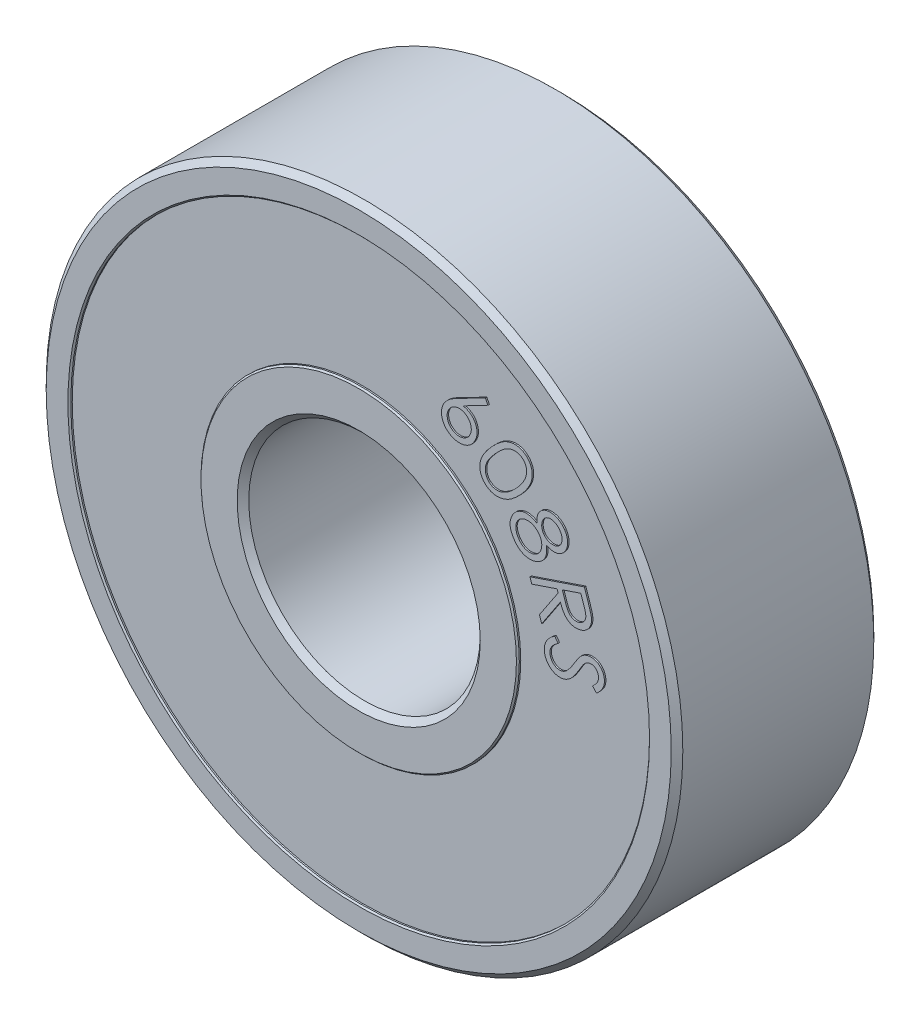
from build123d import *

# Parameters (mm, degrees)
SKETCH1_R           = 11
SKETCH1_R_2         = 4
BOSS_EXTRUDE1_DEPTH = 7
SKETCH2_R           = 10
SKETCH2_R_2         = 5.5
CUT_EXTRUDE1_DEPTH  = 0.1
CUT_EXTRUDE2_START  = -6.9
SKETCH2_2_R         = 10
SKETCH2_2_R_2       = 5.5
CUT_EXTRUDE2_DEPTH  = 0.1
CHAMFER1_SIZE       = 0.2
CHAMFER2_SIZE       = 0.05
BOSS_EXTRUDE2_DEPTH = 0.05
BOSS_EXTRUDE3_DEPTH = 0.05


with BuildPart() as part:
    # Sketch1 → Boss-Extrude1 (new body)
    with BuildSketch(Plane.XY):
        Circle(SKETCH1_R)
        Circle(SKETCH1_R_2, mode=Mode.SUBTRACT)
    extrude(amount=BOSS_EXTRUDE1_DEPTH)

    # Sketch2 → Cut-Extrude1 (cut)
    with BuildSketch(Plane.XY.offset(7)):
        Circle(SKETCH2_R)
        Circle(SKETCH2_R_2, mode=Mode.SUBTRACT)
    extrude(amount=-CUT_EXTRUDE1_DEPTH, mode=Mode.SUBTRACT)

    # Sketch2<2> → Cut-Extrude2 (cut)
    with BuildSketch(Plane.XY.offset(7).offset(CUT_EXTRUDE2_START)):
        Circle(SKETCH2_2_R)
        Circle(SKETCH2_2_R_2, mode=Mode.SUBTRACT)
    extrude(amount=-CUT_EXTRUDE2_DEPTH, mode=Mode.SUBTRACT)

    # Chamfer1
    chamfer1_edges = [part.edges().sort_by_distance(p)[0] for p in [
        (-11, 0, 0),
        (-11, 0, 7),
        (-4, 0, 0),
        (-4, 0, 7),
    ]]
    chamfer(chamfer1_edges, length=CHAMFER1_SIZE)

    # Chamfer2
    chamfer2_edges = [part.edges().sort_by_distance(p)[0] for p in [
        (-10, 0, 7),
        (-5.5, 0, 7),
        (-10, 0, 0),
        (-5.5, 0, 0),
    ]]
    chamfer(chamfer2_edges, length=CHAMFER2_SIZE)

    # Sketch3 → Boss-Extrude2 (add)
    # profile 1 of 5: a face of its own
    with BuildSketch(Plane(origin=(0, 0, 0.1), x_dir=(-1, 0, 0), z_dir=(0, 0, -1))):
        with BuildLine():
            Line((6.723953336, 1.374086402), (6.841741797, 1.216634479))
            add(Edge.make_bspline(
                [(6.841741797, 1.216634479), (6.817573288, 1.199359859), (6.771292818, 1.166280551), (6.7089583, 1.113159264), (6.65797847, 1.058354359), (6.616042027, 1.003718422), (6.585197602, 0.947642508), (6.564677897, 0.890789262), (6.554264641, 0.832905218), (6.556279326, 0.794387119), (6.557286669, 0.775128069)],
                knots=[0, 0, 0, 0, 1.292055059, 2.474166467, 3.555169481, 4.54276915, 5.463097752, 6.326728609, 7.163364304, 8, 8, 8, 8], degree=3))
            add(Edge.make_bspline(
                [(6.557286669, 0.775128069), (6.559589482, 0.75889953), (6.564156821, 0.726712276), (6.577499183, 0.679747808), (6.597073867, 0.635157474), (6.621192779, 0.592867963), (6.650084971, 0.554531373), (6.683420565, 0.521824686), (6.71962411, 0.494193194), (6.759139635, 0.472574946), (6.800541147, 0.456589651), (6.843001787, 0.446611622), (6.8860034, 0.441689172), (6.914655203, 0.443624683), (6.929081541, 0.444599223)],
                knots=[0, 0, 0, 0, 1.065647424, 2.113576877, 3.164384275, 4.227051853, 5.274981306, 6.276492859, 7.256630379, 8.228879028, 9.197081163, 10.13494145, 11.060932943, 12, 12, 12, 12], degree=3))
            add(Edge.make_bspline(
                [(6.929081541, 0.444599223), (6.945519436, 0.447087772), (6.978756008, 0.45211949), (7.026704444, 0.470689174), (7.073741901, 0.496394668), (7.101970562, 0.519552155), (7.116581541, 0.531538325)],
                knots=[0, 0, 0, 0, 0.947990027, 1.916786729, 2.921741833, 4, 4, 4, 4], degree=3))
            add(Edge.make_bspline(
                [(7.116581541, 0.531538325), (7.127135431, 0.541011836), (7.149222449, 0.560837855), (7.181222658, 0.595056366), (7.214764351, 0.633812728), (7.249572833, 0.677474782), (7.285307224, 0.726179014), (7.3219168, 0.780016687), (7.360652209, 0.838318589), (7.38569458, 0.879600754), (7.398632823, 0.900929351)],
                knots=[0, 0, 0, 0, 0.729441018, 1.526562937, 2.408317325, 3.366672661, 4.398852945, 5.515801495, 6.716528806, 8, 8, 8, 8], degree=3))
            add(Edge.make_bspline(
                [(7.398632823, 0.900929351), (7.411481182, 0.922096096), (7.436017587, 0.962518055), (7.472820572, 1.019379999), (7.50609449, 1.07074534), (7.537338687, 1.115557702), (7.565826722, 1.154147196), (7.591394823, 1.186795914), (7.614407064, 1.213420818), (7.629713327, 1.228338761), (7.636613592, 1.235063966)],
                knots=[0, 0, 0, 0, 1.445236574, 2.759956344, 3.953419532, 5.017350228, 5.948124348, 6.752849745, 7.43776821, 8, 8, 8, 8], degree=3))
            add(Edge.make_bspline(
                [(7.636613592, 1.235063966), (7.647453442, 1.244543907), (7.668850152, 1.263256302), (7.702463752, 1.288692966), (7.737555465, 1.310371795), (7.773613033, 1.328839241), (7.810780176, 1.344090457), (7.848714771, 1.356654507), (7.887907457, 1.365581106), (7.91448874, 1.368839266), (7.927879618, 1.370480633)],
                knots=[0, 0, 0, 0, 1.056756624, 2.085925105, 3.08957304, 4.080262677, 5.055903979, 6.035378084, 7.010280581, 8, 8, 8, 8], degree=3))
            add(Edge.make_bspline(
                [(7.927879618, 1.370480633), (7.948981269, 1.371870248), (7.990587385, 1.37461015), (8.052279005, 1.368496586), (8.111981804, 1.355515205), (8.168798048, 1.333504491), (8.222511066, 1.304967414), (8.271642008, 1.26880591), (8.315398275, 1.225611054), (8.35382237, 1.176261797), (8.385992991, 1.122092785), (8.41166226, 1.064244335), (8.429536588, 1.002885194), (8.435353033, 0.960458902), (8.438296284, 0.938990248)],
                knots=[0, 0, 0, 0, 1.01991207, 2.010960161, 2.982781706, 3.962746851, 4.943984954, 5.912890685, 6.898148972, 7.904611514, 8.925685622, 9.933656005, 10.954383679, 12, 12, 12, 12], degree=3))
            add(Edge.make_bspline(
                [(8.438296284, 0.938990248), (8.439905173, 0.916018968), (8.443100643, 0.870394895), (8.435954309, 0.802226976), (8.421251944, 0.735375989), (8.401131857, 0.681031699), (8.37977872, 0.638088379), (8.360564, 0.604548729), (8.337040201, 0.570775496), (8.310670734, 0.53558058), (8.279863744, 0.500254418), (8.246489716, 0.463106616), (8.208609747, 0.426121993), (8.181946924, 0.401530075), (8.168264233, 0.38891012)],
                knots=[0, 0, 0, 0, 1.294867467, 2.571782184, 3.843746611, 5.143215914, 5.822746795, 6.543964101, 7.318006915, 8.13942962, 9.019769218, 9.956863672, 10.951513765, 12, 12, 12, 12], degree=3))
            Line((8.168264233, 0.38891012), (8.029642438, 0.537547941))
            add(Edge.make_bspline(
                [(8.029642438, 0.537547941), (8.040491364, 0.547797716), (8.061430909, 0.567580842), (8.091198861, 0.596726402), (8.1177117, 0.624750316), (8.140998798, 0.651703899), (8.161430413, 0.677149832), (8.178807729, 0.701361339), (8.193307277, 0.724006553), (8.208313949, 0.752376209), (8.222111687, 0.78797107), (8.232490263, 0.831773931), (8.237254627, 0.876823898), (8.235338696, 0.906937777), (8.234370002, 0.922163325)],
                knots=[0, 0, 0, 0, 1.182699611, 2.282732375, 3.300866298, 4.238668036, 5.104698929, 5.88587987, 6.599324344, 7.233663973, 8.426546453, 9.612413994, 10.792838817, 12, 12, 12, 12], degree=3))
            add(Edge.make_bspline(
                [(8.234370002, 0.922163325), (8.231544844, 0.941132772), (8.226095153, 0.97772457), (8.207511221, 1.029103552), (8.179226125, 1.07342249), (8.143481188, 1.110786437), (8.101919482, 1.139998909), (8.056290048, 1.160326247), (8.006902954, 1.169811767), (7.973443836, 1.168186943), (7.956325131, 1.167355633)],
                knots=[0, 0, 0, 0, 1.109513479, 2.140235993, 3.138523126, 4.134648421, 5.117916045, 6.063936821, 7.00945106, 8, 8, 8, 8], degree=3))
            add(Edge.make_bspline(
                [(7.956325131, 1.167355633), (7.945745182, 1.165793238), (7.92452439, 1.162659454), (7.893216116, 1.154810012), (7.863019919, 1.142853978), (7.833191485, 1.128051735), (7.803915641, 1.108026169), (7.773495168, 1.083650001), (7.743435661, 1.052289809), (7.723571823, 1.029230065), (7.713136028, 1.017115248)],
                knots=[0, 0, 0, 0, 0.872627401, 1.750277355, 2.626708255, 3.518723759, 4.461878059, 5.515567722, 6.694762481, 8, 8, 8, 8], degree=3))
            add(Edge.make_bspline(
                [(7.713136028, 1.017115248), (7.709759885, 1.012601252), (7.701657657, 1.00176835), (7.688608104, 0.982001066), (7.672276268, 0.956433232), (7.65262288, 0.924978085), (7.629276842, 0.887948617), (7.60342511, 0.84439932), (7.573757222, 0.795347482), (7.552995234, 0.760582288), (7.54206231, 0.742275505)],
                knots=[0, 0, 0, 0, 0.417704147, 1.002426291, 1.754721007, 2.666443671, 3.751275867, 4.998903859, 6.419671761, 8, 8, 8, 8], degree=3))
            add(Edge.make_bspline(
                [(7.54206231, 0.742275505), (7.528720878, 0.72014766), (7.502869753, 0.677271475), (7.462909444, 0.616494005), (7.424908705, 0.560118495), (7.386533341, 0.509633022), (7.349495907, 0.463846731), (7.313037636, 0.423278472), (7.277439614, 0.387815365), (7.231706317, 0.348414155), (7.174122265, 0.307697522), (7.102778014, 0.269865497), (7.029575045, 0.243643782), (6.979473401, 0.23602383), (6.954722566, 0.232259479)],
                knots=[0, 0, 0, 0, 1.151589416, 2.231385892, 3.241866087, 4.181198595, 5.056967968, 5.86622306, 6.611257172, 7.295010099, 8.555133183, 9.745337415, 10.8861687, 12, 12, 12, 12], degree=3))
            add(Edge.make_bspline(
                [(6.954722566, 0.232259479), (6.937104145, 0.230954156), (6.902273291, 0.228373588), (6.850287945, 0.230996996), (6.799553841, 0.238604602), (6.7498888, 0.251362609), (6.70178582, 0.270191913), (6.654518449, 0.293243368), (6.609132064, 0.322693373), (6.565113537, 0.35621304), (6.524107945, 0.393956855), (6.487534332, 0.434933646), (6.45562657, 0.478557564), (6.428202178, 0.524760922), (6.405676349, 0.573922386), (6.388114701, 0.625763552), (6.37509852, 0.680239147), (6.370249322, 0.717645223), (6.367783464, 0.73666653)],
                knots=[0, 0, 0, 0, 0.985637329, 1.948562123, 2.898699275, 3.846375535, 4.804641011, 5.778360361, 6.777444169, 7.819911255, 8.864722404, 9.88397061, 10.881717925, 11.877903731, 12.878850076, 13.895148367, 14.929665032, 16, 16, 16, 16], degree=3))
            add(Edge.make_bspline(
                [(6.367783464, 0.73666653), (6.366427586, 0.751479961), (6.36374365, 0.780802889), (6.364781078, 0.824712107), (6.366958187, 0.867892434), (6.373888092, 0.910243045), (6.38267062, 0.952061727), (6.395985544, 0.99277455), (6.410879198, 1.033227048), (6.430041569, 1.072638466), (6.452506534, 1.111705681), (6.479103013, 1.150236727), (6.509821859, 1.188344837), (6.544257517, 1.226550474), (6.583270723, 1.264064543), (6.626226549, 1.301327262), (6.673295047, 1.338362343), (6.706747289, 1.361952754), (6.723953336, 1.374086402)],
                knots=[0, 0, 0, 0, 0.924783812, 1.830593555, 2.729938474, 3.612542721, 4.497647048, 5.385983185, 6.274940971, 7.178116819, 8.108855036, 9.07694148, 10.087910257, 11.152769032, 12.275211649, 13.45327497, 14.690100631, 16, 16, 16, 16], degree=3))
        make_face()
    # profile 2 of 5: a face of its own
    with BuildSketch(Plane(origin=(0, 0, 0.1), x_dir=(-1, 0, 0), z_dir=(0, 0, -1))):
        with BuildLine():
            Line((7.746137114, 3.357649879), (7.872739678, 2.983451161))
            add(Edge.make_bspline(
                [(7.872739678, 2.983451161), (7.881059185, 2.958357449), (7.896967784, 2.910373143), (7.919192418, 2.841249827), (7.93827157, 2.778162874), (7.954988951, 2.721116942), (7.968277975, 2.670083531), (7.97810167, 2.624967975), (7.986304921, 2.586220173), (7.989206196, 2.562134117), (7.99052814, 2.551159494)],
                knots=[0, 0, 0, 0, 1.41401025, 2.703876705, 3.883389485, 4.939117467, 5.883308228, 6.703003456, 7.409033675, 8, 8, 8, 8], degree=3))
            add(Edge.make_bspline(
                [(7.99052814, 2.551159494), (7.991680371, 2.536346044), (7.993961878, 2.507014281), (7.99355178, 2.463189389), (7.989536296, 2.420458725), (7.982244147, 2.378807362), (7.971867446, 2.338150413), (7.957859366, 2.298427821), (7.940049121, 2.259949253), (7.919392559, 2.222682043), (7.895267023, 2.187520322), (7.868522083, 2.15435442), (7.838146422, 2.124526727), (7.805654899, 2.096319063), (7.769505392, 2.071821996), (7.730676725, 2.049581161), (7.689074117, 2.029824145), (7.65969703, 2.019263938), (7.644774935, 2.013899879)],
                knots=[0, 0, 0, 0, 1.027353843, 2.034239082, 3.026914782, 3.992754084, 4.956116645, 5.926055136, 6.901519887, 7.885736109, 8.869562139, 9.847691085, 10.827432488, 11.810304063, 12.819812835, 13.841795782, 14.903739854, 16, 16, 16, 16], degree=3))
            add(Edge.make_bspline(
                [(7.644774935, 2.013899879), (7.619571721, 2.006225956), (7.570483848, 1.991279587), (7.495245456, 1.981482942), (7.421726968, 1.981550073), (7.350113043, 1.99285135), (7.28164526, 2.01459628), (7.217050526, 2.046407449), (7.157909987, 2.089546729), (7.111856988, 2.132170274), (7.078246075, 2.172604827), (7.052872874, 2.206693439), (7.028502864, 2.24470871), (7.00542963, 2.286885007), (6.981948203, 2.332291093), (6.960215509, 2.382102891), (6.938952909, 2.435460163), (6.925647847, 2.472458787), (6.918813396, 2.491463981)],
                knots=[0, 0, 0, 0, 1.278263464, 2.489652168, 3.670679834, 4.839936614, 5.997393751, 7.149490657, 8.321732671, 9.542815408, 10.187555536, 10.874109659, 11.606713321, 12.379429923, 13.209421677, 14.089665205, 15.018712606, 16, 16, 16, 16], degree=3))
            Line((6.918813396, 2.491463981), (6.274181986, 1.519909494))
            Line((6.274181986, 1.519909494), (6.195656345, 1.75268193))
            Line((6.195656345, 1.75268193), (6.840688396, 2.722633853))
            Line((6.840688396, 2.722633853), (6.804630704, 2.829605007))
            Line((6.804630704, 2.829605007), (5.931233268, 2.53393193))
            Line((5.931233268, 2.53393193), (5.867531345, 2.721832571))
            Line((5.867531345, 2.721832571), (7.746137114, 3.357649879))
        make_face()
        with BuildLine():
            Line((7.625944806, 3.107649879), (6.987323011, 2.891303725))
            Line((6.987323011, 2.891303725), (7.093893524, 2.567585776))
            add(Edge.make_bspline(
                [(7.093893524, 2.567585776), (7.099141602, 2.552460366), (7.109268083, 2.523274973), (7.12546665, 2.481526975), (7.141165795, 2.442969417), (7.157905934, 2.408224542), (7.173577508, 2.37635315), (7.19005439, 2.34833638), (7.206517147, 2.323717963), (7.228098548, 2.295648952), (7.257158343, 2.265709238), (7.296463649, 2.236869944), (7.338965987, 2.214103265), (7.38510297, 2.199047445), (7.432884658, 2.190547052), (7.481570808, 2.189590563), (7.530612026, 2.194710922), (7.562229046, 2.204464605), (7.578268524, 2.209412699)],
                knots=[0, 0, 0, 0, 1.118554581, 2.158318542, 3.128777667, 4.026236993, 4.852521549, 5.609511046, 6.2953485, 6.920617761, 8.081985124, 9.196171859, 10.314843201, 11.436157874, 12.572935431, 13.69304583, 14.829670183, 16, 16, 16, 16], degree=3))
            add(Edge.make_bspline(
                [(7.578268524, 2.209412699), (7.59342902, 2.215251964), (7.62342383, 2.226804859), (7.664579795, 2.251684726), (7.701464878, 2.282014563), (7.733367565, 2.317620085), (7.759719917, 2.357194019), (7.780045409, 2.399320856), (7.793065142, 2.44385535), (7.798012121, 2.482767203), (7.798617957, 2.516069958), (7.796430694, 2.544330853), (7.791830588, 2.575579595), (7.785411015, 2.609926292), (7.776957572, 2.647370858), (7.766058218, 2.687842945), (7.752740917, 2.731460489), (7.742856393, 2.761514748), (7.737723652, 2.777121033)],
                knots=[0, 0, 0, 0, 1.157480747, 2.290057996, 3.413820966, 4.554229024, 5.688088466, 6.796349954, 7.878911532, 8.984095935, 9.584534887, 10.253304793, 11.003966908, 11.837573395, 12.74613744, 13.742422656, 14.827707137, 16, 16, 16, 16], degree=3))
            Line((7.737723652, 2.777121033), (7.625944806, 3.107649879))
        make_face(mode=Mode.SUBTRACT)
    # profile 3 of 5: a face of its own
    with BuildSketch(Plane(origin=(0, 0, 0.1), x_dir=(-1, 0, 0), z_dir=(0, 0, -1))):
        with BuildLine():
            add(Edge.make_bspline(
                [(6.436645373, 3.958851709), (6.438849744, 3.940573746), (6.443153326, 3.904889774), (6.446080097, 3.852458084), (6.447345332, 3.802571834), (6.444615596, 3.755237655), (6.440242818, 3.710182835), (6.431945321, 3.667690701), (6.421801836, 3.627540907), (6.408467872, 3.589869698), (6.392118978, 3.554645749), (6.374421381, 3.520656156), (6.353059749, 3.489126668), (6.330588283, 3.458332588), (6.304473045, 3.429986163), (6.276658623, 3.402650225), (6.246016539, 3.377299569), (6.224148017, 3.36201487), (6.213087681, 3.354284402)],
                knots=[0, 0, 0, 0, 1.290890309, 2.520198396, 3.681805585, 4.788490099, 5.843551436, 6.853927339, 7.821726867, 8.74603337, 9.651448064, 10.544029729, 11.429902383, 12.319727641, 13.215057227, 14.129151139, 15.053789794, 16, 16, 16, 16], degree=3))
            add(Edge.make_bspline(
                [(6.213087681, 3.354284402), (6.197080539, 3.344144505), (6.165376402, 3.324061175), (6.115609733, 3.298721518), (6.064443052, 3.278646051), (6.012154311, 3.263322512), (5.958510855, 3.252871046), (5.903673026, 3.247212262), (5.847609117, 3.246868388), (5.810160039, 3.250090216), (5.791212681, 3.251720299)],
                knots=[0, 0, 0, 0, 1.02459754, 2.029343036, 3.015319328, 3.993724459, 4.972689464, 5.967517749, 6.971665777, 8, 8, 8, 8], degree=3))
            add(Edge.make_bspline(
                [(5.791212681, 3.251720299), (5.76812279, 3.255152686), (5.722105673, 3.26199328), (5.655371216, 3.282467937), (5.591465368, 3.310695655), (5.530691013, 3.347287029), (5.472409223, 3.391028314), (5.417139616, 3.44291569), (5.364964002, 3.502778785), (5.333693598, 3.547097948), (5.317654988, 3.569829274)],
                knots=[0, 0, 0, 0, 0.94927729, 1.891867025, 2.831441269, 3.787189233, 4.773456595, 5.792841766, 6.867947176, 8, 8, 8, 8], degree=3))
            add(Edge.make_bspline(
                [(5.317654988, 3.569829274), (5.303063571, 3.592276258), (5.274661246, 3.635969511), (5.240442419, 3.70396576), (5.213126694, 3.770723532), (5.193673612, 3.836759996), (5.18189304, 3.902041339), (5.177652501, 3.9664582), (5.181746591, 4.030123994), (5.193666901, 4.092147537), (5.210811163, 4.152011519), (5.232533781, 4.208453206), (5.257704373, 4.261497857), (5.287473484, 4.310315858), (5.320899663, 4.355598373), (5.358263051, 4.396995678), (5.399718813, 4.434649249), (5.43013903, 4.456340746), (5.445459476, 4.467265171)],
                knots=[0, 0, 0, 0, 1.265189782, 2.462703114, 3.593198436, 4.67234407, 5.711673085, 6.724080211, 7.71757927, 8.719632106, 9.70506986, 10.658584755, 11.576575664, 12.477685061, 13.358041525, 14.234425087, 15.110808649, 16, 16, 16, 16], degree=3))
            add(Edge.make_bspline(
                [(5.445459476, 4.467265171), (5.456987966, 4.474624406), (5.480000329, 4.489314395), (5.515649837, 4.508441139), (5.552366299, 4.524126629), (5.589327481, 4.537519912), (5.627481553, 4.547343512), (5.665928122, 4.555312832), (5.705401353, 4.558925918), (5.745399858, 4.560814177), (5.786673455, 4.559096182), (5.829078302, 4.554049573), (5.872697014, 4.544281293), (5.91778122, 4.532182679), (5.964098431, 4.515785424), (6.011833619, 4.496274612), (6.060588671, 4.472457347), (6.093098017, 4.454707355), (6.109722296, 4.445630556)],
                knots=[0, 0, 0, 0, 0.931334836, 1.859065266, 2.751202648, 3.648748233, 4.533436264, 5.43245535, 6.319384756, 7.229651734, 8.158095254, 9.129430785, 10.133761898, 11.19951572, 12.306952597, 13.477470392, 14.710056011, 16, 16, 16, 16], degree=3))
            add(Edge.make_bspline(
                [(6.109722296, 4.445630556), (6.107482301, 4.47205299), (6.10313889, 4.52328682), (6.107287375, 4.598282233), (6.11985051, 4.668288878), (6.14164351, 4.732865757), (6.171434346, 4.791786736), (6.208476731, 4.844446438), (6.252045054, 4.891203726), (6.28610488, 4.91622277), (6.303231911, 4.928803633)],
                knots=[0, 0, 0, 0, 1.159116483, 2.247558892, 3.275615725, 4.262372356, 5.218835671, 6.154236364, 7.07185513, 8, 8, 8, 8], degree=3))
            add(Edge.make_bspline(
                [(6.303231911, 4.928803633), (6.321754889, 4.940084937), (6.359014229, 4.962777505), (6.421256217, 4.986222737), (6.488036273, 5.000993457), (6.558445944, 5.007117844), (6.630670913, 5.005090507), (6.702669609, 4.992413163), (6.77329377, 4.969774079), (6.841463499, 4.937151075), (6.906181416, 4.896456921), (6.965941656, 4.848096386), (7.019799943, 4.792057066), (7.050247347, 4.749841495), (7.065651783, 4.72848312)],
                knots=[0, 0, 0, 0, 0.892779067, 1.795842916, 2.727080536, 3.70581188, 4.703144711, 5.698163754, 6.710047702, 7.752069251, 8.806330382, 9.855631886, 10.91508709, 12, 12, 12, 12], degree=3))
            add(Edge.make_bspline(
                [(7.065651783, 4.72848312), (7.079336383, 4.706774175), (7.106401224, 4.663839111), (7.136261198, 4.594226894), (7.157475004, 4.522286133), (7.168858659, 4.44845505), (7.171401759, 4.374581199), (7.164611604, 4.302250625), (7.148558493, 4.232231558), (7.122885922, 4.165630452), (7.089294662, 4.103906053), (7.0495902, 4.047721731), (7.002341174, 3.999113654), (6.966283703, 3.972535032), (6.948263963, 3.95925235)],
                knots=[0, 0, 0, 0, 1.068771019, 2.113771646, 3.146516798, 4.18939315, 5.220229497, 6.221594843, 7.210477599, 8.206485729, 9.188317762, 10.134173663, 11.067552274, 12, 12, 12, 12], degree=3))
            add(Edge.make_bspline(
                [(6.948263963, 3.95925235), (6.92948131, 3.947579211), (6.892704816, 3.924723167), (6.832726752, 3.900840341), (6.770949722, 3.886814804), (6.707208907, 3.88185386), (6.641795956, 3.887028294), (6.57452711, 3.90142974), (6.505301459, 3.925243395), (6.460060234, 3.947389739), (6.436645373, 3.958851709)],
                knots=[0, 0, 0, 0, 0.981875121, 1.922514633, 2.854567088, 3.789622669, 4.754286786, 5.76174218, 6.841576559, 8, 8, 8, 8], degree=3))
        make_face()
        with BuildLine():
            add(Edge.make_bspline(
                [(6.899786399, 4.627521581), (6.89206632, 4.638457323), (6.87685916, 4.659998761), (6.851731015, 4.689696603), (6.824543522, 4.715861262), (6.79632334, 4.739189166), (6.766173857, 4.759065259), (6.734647119, 4.775820377), (6.701543011, 4.789622008), (6.667263629, 4.799834203), (6.632827413, 4.807110393), (6.598864764, 4.810677554), (6.565845271, 4.811257308), (6.533573133, 4.808043896), (6.502305027, 4.801150813), (6.471895114, 4.791090338), (6.442508709, 4.777396374), (6.423983999, 4.765933971), (6.414610117, 4.760133761)],
                knots=[0, 0, 0, 0, 1.147797877, 2.260954539, 3.330167184, 4.38025149, 5.396817843, 6.421610434, 7.438370352, 8.467442645, 9.485040915, 10.452679454, 11.391973248, 12.312859485, 13.227240642, 14.132754951, 15.055135845, 16, 16, 16, 16], degree=3))
            add(Edge.make_bspline(
                [(6.414610117, 4.760133761), (6.405774199, 4.753786345), (6.388108367, 4.741095827), (6.364373565, 4.718498267), (6.343734102, 4.693036444), (6.324762197, 4.66560438), (6.309508042, 4.635122756), (6.296405059, 4.602338894), (6.286620035, 4.566820361), (6.27902636, 4.529487679), (6.274755334, 4.491152689), (6.273205383, 4.453199531), (6.276275975, 4.416049243), (6.282273469, 4.379861769), (6.29134367, 4.344469632), (6.304515391, 4.310097751), (6.320673305, 4.276359421), (6.334378057, 4.255189882), (6.341292809, 4.244508761)],
                knots=[0, 0, 0, 0, 0.908844192, 1.81707094, 2.729132775, 3.645761934, 4.599514883, 5.571907187, 6.593318126, 7.675011067, 8.753876802, 9.815092739, 10.84525358, 11.863975947, 12.879511735, 13.893573417, 14.937199413, 16, 16, 16, 16], degree=3))
            add(Edge.make_bspline(
                [(6.341292809, 4.244508761), (6.350814274, 4.231255034), (6.369827412, 4.204789049), (6.404691636, 4.170598056), (6.443344082, 4.140394154), (6.485652106, 4.115036742), (6.53091205, 4.095367527), (6.577788532, 4.082025189), (6.625777609, 4.074990316), (6.673984131, 4.075405122), (6.721007008, 4.080627131), (6.765184168, 4.092077638), (6.806448491, 4.107815252), (6.831074035, 4.122859441), (6.843296014, 4.130326068)],
                knots=[0, 0, 0, 0, 1.029778083, 2.056334151, 3.072742447, 4.125103068, 5.164692881, 6.18264204, 7.197261409, 8.21856438, 9.221531217, 10.179595353, 11.096509409, 12, 12, 12, 12], degree=3))
            add(Edge.make_bspline(
                [(6.843296014, 4.130326068), (6.851446438, 4.13616324), (6.867594435, 4.147728114), (6.88939698, 4.168131937), (6.90904658, 4.190508833), (6.92640353, 4.215277105), (6.941639015, 4.242075679), (6.954455745, 4.271261696), (6.965288178, 4.302452796), (6.973600755, 4.335686204), (6.979511889, 4.370209731), (6.980683648, 4.405777115), (6.977172407, 4.441591107), (6.970465098, 4.478043747), (6.9591051, 4.514969221), (6.943248573, 4.552252268), (6.923519635, 4.590151684), (6.907856867, 4.614813977), (6.899786399, 4.627521581)],
                knots=[0, 0, 0, 0, 0.860567069, 1.704995385, 2.558804371, 3.415153889, 4.298967395, 5.203031682, 6.150124742, 7.132495547, 8.143595732, 9.153914339, 10.17923786, 11.230179396, 12.333615959, 13.490750709, 14.707072956, 16, 16, 16, 16], degree=3))
        make_face(mode=Mode.SUBTRACT)
        with BuildLine():
            add(Edge.make_bspline(
                [(6.192654988, 4.141544017), (6.183073031, 4.155401294), (6.164227572, 4.182655302), (6.131187317, 4.218933327), (6.097015473, 4.252070626), (6.059989677, 4.280785033), (6.020837675, 4.305788703), (5.978908288, 4.326108106), (5.934953683, 4.342757084), (5.889255118, 4.354794419), (5.843074833, 4.363522847), (5.797427161, 4.366805064), (5.753115121, 4.366894985), (5.710232395, 4.361231726), (5.668413788, 4.352462102), (5.628232574, 4.337906769), (5.58882321, 4.320171181), (5.564407056, 4.304523989), (5.552029988, 4.296592094)],
                knots=[0, 0, 0, 0, 1.103096915, 2.169532516, 3.209705979, 4.22005898, 5.235178716, 6.249127762, 7.268541052, 8.31114268, 9.343069619, 10.344088993, 11.307028603, 12.241865975, 13.174241085, 14.101672058, 15.037697202, 16, 16, 16, 16], degree=3))
            add(Edge.make_bspline(
                [(5.552029988, 4.296592094), (5.53739373, 4.285920167), (5.508158373, 4.264603408), (5.470459325, 4.225147952), (5.438160928, 4.180583136), (5.411429753, 4.131524815), (5.391128257, 4.078821031), (5.379712135, 4.02334043), (5.375573245, 3.966204794), (5.379709706, 3.907692931), (5.391978104, 3.848519155), (5.411845955, 3.789219006), (5.439605058, 3.729865997), (5.463581076, 3.692173419), (5.475908194, 3.672794017)],
                knots=[0, 0, 0, 0, 0.926109246, 1.849867156, 2.780058085, 3.737943589, 4.703270699, 5.660960876, 6.627667837, 7.628486545, 8.654526651, 9.714225142, 10.824783286, 12, 12, 12, 12], degree=3))
            add(Edge.make_bspline(
                [(5.475908194, 3.672794017), (5.486060461, 3.658170197), (5.505883669, 3.629615884), (5.539352829, 3.591150094), (5.574498341, 3.557119283), (5.611193238, 3.52754691), (5.649610266, 3.502113814), (5.690285635, 3.482258235), (5.73254201, 3.466467844), (5.776087466, 3.455386323), (5.819965834, 3.44854851), (5.863310687, 3.446190652), (5.905570882, 3.447721693), (5.946649447, 3.453327605), (5.986515083, 3.463003588), (6.025261611, 3.476638949), (6.062787941, 3.494832298), (6.086485292, 3.509769369), (6.098504347, 3.517345299)],
                knots=[0, 0, 0, 0, 1.19035752, 2.32427924, 3.40484362, 4.459799014, 5.473418872, 6.48040078, 7.481219341, 8.486773131, 9.481309882, 10.447796045, 11.386669185, 12.306601008, 13.216804754, 14.126789189, 15.049926509, 16, 16, 16, 16], degree=3))
            add(Edge.make_bspline(
                [(6.098504347, 3.517345299), (6.109623379, 3.525413647), (6.131612455, 3.541369668), (6.161538623, 3.568937135), (6.18821179, 3.599437638), (6.210866349, 3.633334346), (6.230793072, 3.669716469), (6.247216973, 3.709047676), (6.259874558, 3.751393122), (6.269542145, 3.795841921), (6.274911413, 3.841443699), (6.276921551, 3.886781556), (6.273360853, 3.931306877), (6.266335015, 3.975088203), (6.254596548, 4.018173699), (6.238424813, 4.06039773), (6.21802423, 4.101939076), (6.201197342, 4.128208206), (6.192654988, 4.141544017)],
                knots=[0, 0, 0, 0, 0.942671861, 1.864234432, 2.78725575, 3.718123832, 4.657802721, 5.631928245, 6.638488188, 7.688830978, 8.751153965, 9.788000563, 10.799352584, 11.812407604, 12.828984143, 13.859322421, 14.913261601, 16, 16, 16, 16], degree=3))
        make_face(mode=Mode.SUBTRACT)
    # profile 4 of 5: a face of its own
    with BuildSketch(Plane(origin=(0, 0, 0.1), x_dir=(-1, 0, 0), z_dir=(0, 0, -1))):
        with BuildLine():
            add(Edge.make_bspline(
                [(4.543033426, 5.949335529), (4.564943157, 5.972693181), (4.607527355, 6.018091587), (4.67157506, 6.0821776), (4.733665606, 6.140505217), (4.794137626, 6.192741517), (4.85293655, 6.238729797), (4.909649751, 6.279135227), (4.964441144, 6.313866459), (5.018164906, 6.342452083), (5.070566701, 6.366205448), (5.122024451, 6.38603643), (5.172895525, 6.401712181), (5.223134838, 6.413290127), (5.272621026, 6.421532789), (5.321665929, 6.425568094), (5.370160168, 6.42549656), (5.417968316, 6.42189385), (5.464631842, 6.414853045), (5.509827437, 6.403785557), (5.553710443, 6.389848585), (5.596047144, 6.372253298), (5.636808987, 6.351171515), (5.676066811, 6.327121226), (5.714074787, 6.299926787), (5.737519741, 6.279144916), (5.749363554, 6.268646427)],
                knots=[0, 0, 0, 0, 1.642537938, 3.192470103, 4.646338539, 6.011168142, 7.289605298, 8.473669563, 9.581665276, 10.614373007, 11.59226402, 12.531086133, 13.441104306, 14.320069679, 15.173659948, 16.012137794, 16.84096325, 17.65841702, 18.469272155, 19.258427056, 20.042601694, 20.82874835, 21.606886513, 22.39398752, 23.188682081, 24, 24, 24, 24], degree=3))
            add(Edge.make_bspline(
                [(5.749363554, 6.268646427), (5.760911716, 6.257617316), (5.783832443, 6.2357268), (5.814606127, 6.199685182), (5.842763625, 6.162273296), (5.86720813, 6.122744115), (5.888632845, 6.081687155), (5.906688759, 6.038659944), (5.921436917, 5.993756214), (5.933125957, 5.947322605), (5.941123235, 5.899359884), (5.945576238, 5.850210478), (5.945937318, 5.799696325), (5.942178582, 5.748167993), (5.934948076, 5.695283356), (5.923723996, 5.64133292), (5.908257359, 5.586132596), (5.889035669, 5.529625786), (5.865374627, 5.471491833), (5.83582998, 5.412255968), (5.80126516, 5.351314775), (5.761491532, 5.288687708), (5.716170301, 5.224741752), (5.665349958, 5.159251463), (5.609380215, 5.092013278), (5.569231642, 5.047489171), (5.5486424, 5.024656042)],
                knots=[0, 0, 0, 0, 0.812736739, 1.613115341, 2.410193159, 3.195255584, 3.977011722, 4.766451224, 5.568648116, 6.381840011, 7.202505524, 8.042362829, 8.892510741, 9.771967907, 10.671265438, 11.608935862, 12.575845681, 13.588824347, 14.647177854, 15.769502049, 16.957239641, 18.213799721, 19.545973321, 20.947120805, 22.434403522, 24, 24, 24, 24], degree=3))
            add(Edge.make_bspline(
                [(5.5486424, 5.024656042), (5.527680493, 5.002353903), (5.486797486, 4.958856979), (5.424765374, 4.897538301), (5.363751907, 4.841756827), (5.304193874, 4.791136914), (5.245683972, 4.746127832), (5.188196251, 4.706632475), (5.131917607, 4.672564327), (5.076622511, 4.643827313), (5.022302089, 4.620150633), (4.968866404, 4.60056073), (4.916443523, 4.584153257), (4.864386266, 4.572744454), (4.813189003, 4.564345172), (4.762509713, 4.561020629), (4.712689965, 4.560768112), (4.663807528, 4.564917701), (4.616099552, 4.572413487), (4.569931105, 4.58374163), (4.525340014, 4.598193132), (4.482211508, 4.615751886), (4.440882307, 4.637302377), (4.400706003, 4.661523567), (4.362510463, 4.689746565), (4.338690087, 4.710774866), (4.326687272, 4.721370786)],
                knots=[0, 0, 0, 0, 1.559433233, 3.041436978, 4.443008781, 5.770818333, 7.022943957, 8.202580838, 9.32288808, 10.372875569, 11.375398524, 12.339881119, 13.271916542, 14.171621232, 15.053181812, 15.912749435, 16.756523382, 17.589472185, 18.409479342, 19.214872608, 20.008917662, 20.796169375, 21.584390954, 22.381462505, 23.184437513, 24, 24, 24, 24], degree=3))
            add(Edge.make_bspline(
                [(4.326687272, 4.721370786), (4.315260387, 4.732257291), (4.292582092, 4.753863126), (4.262524999, 4.789474989), (4.234216651, 4.825811541), (4.210591491, 4.864827354), (4.189388006, 4.905106752), (4.171852571, 4.947252998), (4.157409917, 4.991049596), (4.146081336, 5.036416821), (4.1385724, 5.083328133), (4.134475716, 5.131406743), (4.134526669, 5.180589449), (4.138668218, 5.230653261), (4.146378676, 5.281762522), (4.157589801, 5.333992266), (4.172890384, 5.387243797), (4.192316993, 5.44187928), (4.216511887, 5.49808747), (4.245828348, 5.556425299), (4.281385112, 5.616628969), (4.322888369, 5.67887757), (4.369244831, 5.744006213), (4.421956893, 5.810719564), (4.480129534, 5.879757147), (4.521656172, 5.925690016), (4.543033426, 5.949335529)],
                knots=[0, 0, 0, 0, 0.809667474, 1.606901415, 2.389915423, 3.171938179, 3.944739181, 4.725317868, 5.512374, 6.310580304, 7.123290289, 7.948912628, 8.785395908, 9.645186643, 10.525642855, 11.437417869, 12.385812245, 13.368196359, 14.41253519, 15.525600646, 16.717987141, 17.999697683, 19.365829755, 20.821103961, 22.363554732, 24, 24, 24, 24], degree=3))
        make_face()
        with BuildLine():
            add(Edge.make_bspline(
                [(4.679251375, 5.818325914), (4.660851677, 5.798119355), (4.625169821, 5.75893352), (4.575066406, 5.700527005), (4.530060028, 5.644381866), (4.490109119, 5.590608243), (4.454150268, 5.539934716), (4.423546398, 5.49144367), (4.398220443, 5.445165553), (4.377241144, 5.40129025), (4.35988931, 5.359114478), (4.347091963, 5.31763911), (4.335718979, 5.277328241), (4.328855361, 5.237439496), (4.323935339, 5.198395489), (4.323658489, 5.159929724), (4.324705927, 5.122099941), (4.332062828, 5.073644615), (4.346039936, 5.016229297), (4.372941953, 4.953168665), (4.40806014, 4.896592751), (4.438775126, 4.865487268), (4.454091118, 4.849976555)],
                knots=[0, 0, 0, 0, 1.475488141, 2.861359785, 4.154121984, 5.359730204, 6.477947551, 7.508249804, 8.453740252, 9.324547233, 10.133287385, 10.913161477, 11.667000762, 12.392548848, 13.096455606, 13.788819075, 14.467224618, 15.137185669, 16.431314552, 17.646052312, 18.826206712, 20, 20, 20, 20], degree=3))
            add(Edge.make_bspline(
                [(4.454091118, 4.849976555), (4.470998304, 4.835844543), (4.504676122, 4.807694658), (4.563731671, 4.776736661), (4.628146618, 4.755513764), (4.685580759, 4.74573126), (4.73346006, 4.743796713), (4.770607522, 4.744784191), (4.808256766, 4.749765726), (4.846476655, 4.7579731), (4.885356808, 4.768707571), (4.924789742, 4.782747964), (4.964461886, 4.800624278), (4.990744591, 4.814196805), (5.004171247, 4.821130401)],
                knots=[0, 0, 0, 0, 1.34190696, 2.672975875, 4.03914862, 5.469008549, 6.211498008, 6.961821166, 7.734266787, 8.525620103, 9.346360653, 10.194610762, 11.077707539, 12, 12, 12, 12], degree=3))
            add(Edge.make_bspline(
                [(5.004171247, 4.821130401), (5.020977638, 4.830421862), (5.055134219, 4.849305423), (5.105185594, 4.881764095), (5.155673749, 4.917150584), (5.205669506, 4.95682755), (5.256454512, 4.999267098), (5.306984725, 5.045647846), (5.35784608, 5.095550455), (5.390788359, 5.130831575), (5.407616759, 5.14885476)],
                knots=[0, 0, 0, 0, 0.882398032, 1.79334748, 2.740232888, 3.715191852, 4.725879822, 5.7816566, 6.866770249, 8, 8, 8, 8], degree=3))
            add(Edge.make_bspline(
                [(5.407616759, 5.14885476), (5.424180747, 5.167029522), (5.45658333, 5.202583114), (5.501733152, 5.256702416), (5.543098053, 5.309660342), (5.58077131, 5.361374876), (5.615025998, 5.411615164), (5.644765307, 5.461224488), (5.670823679, 5.509629921), (5.693361068, 5.556938809), (5.712272001, 5.603065203), (5.727612485, 5.647874505), (5.739126559, 5.691583045), (5.748400632, 5.733736142), (5.752834323, 5.774825331), (5.755220583, 5.814429798), (5.753676352, 5.852830865), (5.746508693, 5.901432573), (5.732173642, 5.958555869), (5.706135375, 6.021663456), (5.67073215, 6.07767327), (5.640308497, 6.108613984), (5.625164836, 6.124015016)],
                knots=[0, 0, 0, 0, 1.327465575, 2.596797036, 3.803974219, 4.954802096, 6.050653377, 7.085610932, 8.075932289, 9.017660852, 9.913387465, 10.766122373, 11.572387875, 12.35293663, 13.093430198, 13.800930815, 14.493692928, 15.163603914, 16.450647312, 17.662487793, 18.836481221, 20, 20, 20, 20], degree=3))
            add(Edge.make_bspline(
                [(5.625164836, 6.124015016), (5.608285103, 6.138200877), (5.574619324, 6.166493862), (5.514977812, 6.196712457), (5.450201973, 6.218295255), (5.392180613, 6.227466046), (5.343795213, 6.230492325), (5.306274605, 6.228545799), (5.268394949, 6.224194501), (5.229871713, 6.21704111), (5.190985821, 6.205984316), (5.151532352, 6.192011613), (5.111544201, 6.174986568), (5.070779705, 6.154839157), (5.028631981, 6.130550497), (4.984923072, 6.100987844), (4.939041603, 6.06649501), (4.89071745, 6.027165691), (4.840939904, 5.982142624), (4.788729648, 5.932288445), (4.734224356, 5.877502417), (4.697964293, 5.838469719), (4.679251375, 5.818325914)],
                knots=[0, 0, 0, 0, 1.186933895, 2.367280006, 3.582519422, 4.861472594, 5.525769364, 6.196917143, 6.886441279, 7.583575583, 8.309531112, 9.066613021, 9.841978912, 10.654534034, 11.520211795, 12.46606624, 13.501419929, 14.618477826, 15.828573167, 17.123883194, 18.515707565, 20, 20, 20, 20], degree=3))
        make_face(mode=Mode.SUBTRACT)
    # profile 5 of 5: a face of its own
    with BuildSketch(Plane(origin=(0, 0, 0.1), x_dir=(-1, 0, 0), z_dir=(0, 0, -1))):
        with BuildLine():
            Line((4.324964443, 7.302356675), (4.416310597, 7.130481675))
            Line((4.416310597, 7.130481675), (3.555733674, 6.680962444))
            add(Edge.make_bspline(
                [(3.555733674, 6.680962444), (3.573820412, 6.677343593), (3.609234202, 6.670257891), (3.660020503, 6.655631802), (3.706959766, 6.637037992), (3.736127944, 6.622159713), (3.750445212, 6.614856675)],
                knots=[0, 0, 0, 0, 1.071524611, 2.098042594, 3.06641979, 4, 4, 4, 4], degree=3))
            add(Edge.make_bspline(
                [(3.750445212, 6.614856675), (3.767080526, 6.605028081), (3.79973166, 6.585736909), (3.844667082, 6.551553291), (3.885064799, 6.513987171), (3.921262857, 6.472864589), (3.951945795, 6.427668961), (3.978773631, 6.379220739), (4.000582274, 6.327012973), (4.018191547, 6.272085969), (4.030461657, 6.21560422), (4.037588265, 6.158731496), (4.038082899, 6.102220894), (4.033932701, 6.045949965), (4.023286554, 5.990142073), (4.007124801, 5.934646585), (3.985547474, 5.879431036), (3.966999274, 5.843995875), (3.957576622, 5.825994495)],
                knots=[0, 0, 0, 0, 1.019907112, 2.001833211, 2.975106465, 3.930005657, 4.888753167, 5.854816606, 6.850530802, 7.872265815, 8.897525529, 9.899342728, 10.89405696, 11.877628612, 12.875140218, 13.888660536, 14.927420607, 16, 16, 16, 16], degree=3))
            add(Edge.make_bspline(
                [(3.957576622, 5.825994495), (3.943401003, 5.802045015), (3.915487215, 5.75488512), (3.862951089, 5.692675141), (3.804519394, 5.638220775), (3.739385216, 5.593013878), (3.669307026, 5.556735668), (3.594664605, 5.530879797), (3.516222355, 5.515258034), (3.435036911, 5.509786674), (3.353146288, 5.514458347), (3.272777466, 5.529881756), (3.194647085, 5.555414913), (3.145724036, 5.580276576), (3.121038161, 5.592821418)],
                knots=[0, 0, 0, 0, 1.033065496, 2.034251297, 3.014475546, 3.995102051, 4.972102283, 5.939302282, 6.921736905, 7.936931798, 8.956451458, 9.962291878, 10.971801474, 12, 12, 12, 12], degree=3))
            add(Edge.make_bspline(
                [(3.121038161, 5.592821418), (3.098026879, 5.606472481), (3.0524791, 5.633492949), (2.992288878, 5.684987892), (2.938815288, 5.742646167), (2.893091356, 5.807005676), (2.856848611, 5.877071666), (2.829822579, 5.95090171), (2.814390825, 6.028443749), (2.808805845, 6.108143214), (2.813547075, 6.188295134), (2.828636553, 6.266552303), (2.852811134, 6.342529378), (2.87690699, 6.389852952), (2.889067007, 6.41373488)],
                knots=[0, 0, 0, 0, 1.012372306, 2.003856587, 2.988821669, 3.987270143, 4.9855775, 5.970178416, 6.956819527, 7.971542281, 8.990660658, 9.990237353, 10.98576963, 12, 12, 12, 12], degree=3))
            add(Edge.make_bspline(
                [(2.889067007, 6.41373488), (2.899540358, 6.431325076), (2.920940833, 6.467267588), (2.960198132, 6.517770314), (3.004943495, 6.567060495), (3.056853524, 6.615148364), (3.117971201, 6.662922917), (3.190061184, 6.711153599), (3.273543427, 6.760845263), (3.334013557, 6.792508176), (3.365829827, 6.809167572)],
                knots=[0, 0, 0, 0, 0.780869162, 1.595570546, 2.436441551, 3.320231236, 4.29319985, 5.394687772, 6.629218754, 8, 8, 8, 8], degree=3))
            Line((3.365829827, 6.809167572), (4.324964443, 7.302356675))
        make_face()
        with BuildLine():
            add(Edge.make_bspline(
                [(3.625044571, 6.485850264), (3.61246774, 6.492363366), (3.587793416, 6.505141338), (3.549283998, 6.520055204), (3.510411292, 6.531042293), (3.47074979, 6.537397013), (3.430752873, 6.539819896), (3.390231954, 6.538126728), (3.349267971, 6.532580911), (3.30840025, 6.522524522), (3.268684526, 6.508902031), (3.230704875, 6.492745024), (3.195685684, 6.472411), (3.163091352, 6.449070139), (3.13272335, 6.422628438), (3.105710691, 6.392249296), (3.080338604, 6.359286415), (3.066163338, 6.335110707), (3.058938802, 6.322789367)],
                knots=[0, 0, 0, 0, 1.036538255, 2.033571136, 3.018249213, 3.98933273, 4.969044784, 5.947780153, 6.95464472, 7.991182975, 9.024116511, 10.027031361, 11.00835282, 11.982631912, 12.959655734, 13.949709709, 14.955053332, 16, 16, 16, 16], degree=3))
            add(Edge.make_bspline(
                [(3.058938802, 6.322789367), (3.052424832, 6.310212609), (3.039645159, 6.28553843), (3.024743633, 6.247027964), (3.013710803, 6.208159143), (3.007523505, 6.168474735), (3.004467656, 6.128522842), (3.006132907, 6.087928786), (3.012460373, 6.047110429), (3.02173914, 6.006096324), (3.035393603, 5.966315568), (3.05221016, 5.928670302), (3.071880169, 5.893304629), (3.095339468, 5.860838927), (3.121746631, 5.830604201), (3.151755643, 5.803329461), (3.184551656, 5.778180829), (3.208612752, 5.764176376), (3.220797776, 5.757084239)],
                knots=[0, 0, 0, 0, 1.037953187, 2.036347074, 3.022369291, 3.994778392, 4.976462996, 5.956534394, 6.96615164, 8.001838703, 9.036182251, 10.044421244, 11.022239489, 11.997848527, 12.976206041, 13.960378582, 14.967094555, 16, 16, 16, 16], degree=3))
            add(Edge.make_bspline(
                [(3.220797776, 5.757084239), (3.233377904, 5.750582598), (3.258058696, 5.737827114), (3.296488373, 5.722763061), (3.335498991, 5.712383777), (3.374971571, 5.706056766), (3.414930952, 5.70302077), (3.455396792, 5.704628759), (3.496203169, 5.71105302), (3.537088515, 5.720284736), (3.576879413, 5.733924196), (3.614591623, 5.750863843), (3.650196609, 5.770325323), (3.682745964, 5.793747685), (3.712577884, 5.820567455), (3.740297359, 5.850138565), (3.765381679, 5.883121331), (3.779402485, 5.907166762), (3.786502904, 5.919343854)],
                knots=[0, 0, 0, 0, 1.038237759, 2.036905372, 3.020616447, 3.993292149, 4.965474482, 5.955602401, 6.955806131, 7.991777144, 9.026404274, 10.034919693, 11.021552688, 11.997429205, 12.968722844, 13.959819387, 14.966811367, 16, 16, 16, 16], degree=3))
            add(Edge.make_bspline(
                [(3.786502904, 5.919343854), (3.793042375, 5.931909999), (3.805987221, 5.956784611), (3.820573205, 5.99569852), (3.831638485, 6.034937419), (3.838525134, 6.074539053), (3.840844134, 6.11470636), (3.839232802, 6.155095551), (3.833585246, 6.196048891), (3.823580038, 6.236788916), (3.809963735, 6.276508839), (3.793718376, 6.314578155), (3.773506953, 6.34968447), (3.750705692, 6.382621156), (3.72391794, 6.412312718), (3.694115201, 6.439628378), (3.661283282, 6.464747606), (3.637227105, 6.478756087), (3.625044571, 6.485850264)],
                knots=[0, 0, 0, 0, 1.036883605, 2.052505109, 3.037511257, 4.020182804, 4.990456222, 5.979292736, 6.976801729, 8.013685334, 9.04696302, 10.050212019, 11.040354247, 12.009295177, 12.979321976, 13.962480355, 14.968158935, 16, 16, 16, 16], degree=3))
        make_face(mode=Mode.SUBTRACT)
    extrude(amount=BOSS_EXTRUDE2_DEPTH)

    # Sketch4 → Boss-Extrude3 (add)
    # profile 1 of 5: a face of its own
    with BuildSketch(Plane.XY.offset(6.9)):
        with BuildLine():
            Line((6.723953336, 1.374086402), (6.841741797, 1.216634479))
            add(Edge.make_bspline(
                [(6.841741797, 1.216634479), (6.817573288, 1.199359859), (6.771292818, 1.166280551), (6.7089583, 1.113159264), (6.65797847, 1.058354359), (6.616042027, 1.003718422), (6.585197602, 0.947642508), (6.564677897, 0.890789262), (6.554264641, 0.832905218), (6.556279326, 0.794387119), (6.557286669, 0.775128069)],
                knots=[0, 0, 0, 0, 1.292055059, 2.474166467, 3.555169481, 4.54276915, 5.463097752, 6.326728609, 7.163364304, 8, 8, 8, 8], degree=3))
            add(Edge.make_bspline(
                [(6.557286669, 0.775128069), (6.559589482, 0.75889953), (6.564156821, 0.726712276), (6.577499183, 0.679747808), (6.597073867, 0.635157474), (6.621192779, 0.592867963), (6.650084971, 0.554531373), (6.683420565, 0.521824686), (6.71962411, 0.494193194), (6.759139635, 0.472574946), (6.800541147, 0.456589651), (6.843001787, 0.446611622), (6.8860034, 0.441689172), (6.914655203, 0.443624683), (6.929081541, 0.444599223)],
                knots=[0, 0, 0, 0, 1.065647424, 2.113576877, 3.164384275, 4.227051853, 5.274981306, 6.276492859, 7.256630379, 8.228879028, 9.197081163, 10.13494145, 11.060932943, 12, 12, 12, 12], degree=3))
            add(Edge.make_bspline(
                [(6.929081541, 0.444599223), (6.945519436, 0.447087772), (6.978756008, 0.45211949), (7.026704444, 0.470689174), (7.073741901, 0.496394668), (7.101970562, 0.519552155), (7.116581541, 0.531538325)],
                knots=[0, 0, 0, 0, 0.947990027, 1.916786729, 2.921741833, 4, 4, 4, 4], degree=3))
            add(Edge.make_bspline(
                [(7.116581541, 0.531538325), (7.127135431, 0.541011836), (7.149222449, 0.560837855), (7.181222658, 0.595056366), (7.214764351, 0.633812728), (7.249572833, 0.677474782), (7.285307224, 0.726179014), (7.3219168, 0.780016687), (7.360652209, 0.838318589), (7.38569458, 0.879600754), (7.398632823, 0.900929351)],
                knots=[0, 0, 0, 0, 0.729441018, 1.526562937, 2.408317325, 3.366672661, 4.398852945, 5.515801495, 6.716528806, 8, 8, 8, 8], degree=3))
            add(Edge.make_bspline(
                [(7.398632823, 0.900929351), (7.411481182, 0.922096096), (7.436017587, 0.962518055), (7.472820572, 1.019379999), (7.50609449, 1.07074534), (7.537338687, 1.115557702), (7.565826722, 1.154147196), (7.591394823, 1.186795914), (7.614407064, 1.213420818), (7.629713327, 1.228338761), (7.636613592, 1.235063966)],
                knots=[0, 0, 0, 0, 1.445236574, 2.759956344, 3.953419532, 5.017350228, 5.948124348, 6.752849745, 7.43776821, 8, 8, 8, 8], degree=3))
            add(Edge.make_bspline(
                [(7.636613592, 1.235063966), (7.647453442, 1.244543907), (7.668850152, 1.263256302), (7.702463752, 1.288692966), (7.737555465, 1.310371795), (7.773613033, 1.328839241), (7.810780176, 1.344090457), (7.848714771, 1.356654507), (7.887907457, 1.365581106), (7.91448874, 1.368839266), (7.927879618, 1.370480633)],
                knots=[0, 0, 0, 0, 1.056756624, 2.085925105, 3.08957304, 4.080262677, 5.055903979, 6.035378084, 7.010280581, 8, 8, 8, 8], degree=3))
            add(Edge.make_bspline(
                [(7.927879618, 1.370480633), (7.948981269, 1.371870248), (7.990587385, 1.37461015), (8.052279005, 1.368496586), (8.111981804, 1.355515205), (8.168798048, 1.333504491), (8.222511066, 1.304967414), (8.271642008, 1.26880591), (8.315398275, 1.225611054), (8.35382237, 1.176261797), (8.385992991, 1.122092785), (8.41166226, 1.064244335), (8.429536588, 1.002885194), (8.435353033, 0.960458902), (8.438296284, 0.938990248)],
                knots=[0, 0, 0, 0, 1.01991207, 2.010960161, 2.982781706, 3.962746851, 4.943984954, 5.912890685, 6.898148972, 7.904611514, 8.925685622, 9.933656005, 10.954383679, 12, 12, 12, 12], degree=3))
            add(Edge.make_bspline(
                [(8.438296284, 0.938990248), (8.439905173, 0.916018968), (8.443100643, 0.870394895), (8.435954309, 0.802226976), (8.421251944, 0.735375989), (8.401131857, 0.681031699), (8.37977872, 0.638088379), (8.360564, 0.604548729), (8.337040201, 0.570775496), (8.310670734, 0.53558058), (8.279863744, 0.500254418), (8.246489716, 0.463106616), (8.208609747, 0.426121993), (8.181946924, 0.401530075), (8.168264233, 0.38891012)],
                knots=[0, 0, 0, 0, 1.294867467, 2.571782184, 3.843746611, 5.143215914, 5.822746795, 6.543964101, 7.318006915, 8.13942962, 9.019769218, 9.956863672, 10.951513765, 12, 12, 12, 12], degree=3))
            Line((8.168264233, 0.38891012), (8.029642438, 0.537547941))
            add(Edge.make_bspline(
                [(8.029642438, 0.537547941), (8.040491364, 0.547797716), (8.061430909, 0.567580842), (8.091198861, 0.596726402), (8.1177117, 0.624750316), (8.140998798, 0.651703899), (8.161430413, 0.677149832), (8.178807729, 0.701361339), (8.193307277, 0.724006553), (8.208313949, 0.752376209), (8.222111687, 0.78797107), (8.232490263, 0.831773931), (8.237254627, 0.876823898), (8.235338696, 0.906937777), (8.234370002, 0.922163325)],
                knots=[0, 0, 0, 0, 1.182699611, 2.282732375, 3.300866298, 4.238668036, 5.104698929, 5.88587987, 6.599324344, 7.233663973, 8.426546453, 9.612413994, 10.792838817, 12, 12, 12, 12], degree=3))
            add(Edge.make_bspline(
                [(8.234370002, 0.922163325), (8.231544844, 0.941132772), (8.226095153, 0.97772457), (8.207511221, 1.029103552), (8.179226125, 1.07342249), (8.143481188, 1.110786437), (8.101919482, 1.139998909), (8.056290048, 1.160326247), (8.006902954, 1.169811767), (7.973443836, 1.168186943), (7.956325131, 1.167355633)],
                knots=[0, 0, 0, 0, 1.109513479, 2.140235993, 3.138523126, 4.134648421, 5.117916045, 6.063936821, 7.00945106, 8, 8, 8, 8], degree=3))
            add(Edge.make_bspline(
                [(7.956325131, 1.167355633), (7.945745182, 1.165793238), (7.92452439, 1.162659454), (7.893216116, 1.154810012), (7.863019919, 1.142853978), (7.833191485, 1.128051735), (7.803915641, 1.108026169), (7.773495168, 1.083650001), (7.743435661, 1.052289809), (7.723571823, 1.029230065), (7.713136028, 1.017115248)],
                knots=[0, 0, 0, 0, 0.872627401, 1.750277355, 2.626708255, 3.518723759, 4.461878059, 5.515567722, 6.694762481, 8, 8, 8, 8], degree=3))
            add(Edge.make_bspline(
                [(7.713136028, 1.017115248), (7.709759885, 1.012601252), (7.701657657, 1.00176835), (7.688608104, 0.982001066), (7.672276268, 0.956433232), (7.65262288, 0.924978085), (7.629276842, 0.887948617), (7.60342511, 0.84439932), (7.573757222, 0.795347482), (7.552995234, 0.760582288), (7.54206231, 0.742275505)],
                knots=[0, 0, 0, 0, 0.417704147, 1.002426291, 1.754721007, 2.666443671, 3.751275867, 4.998903859, 6.419671761, 8, 8, 8, 8], degree=3))
            add(Edge.make_bspline(
                [(7.54206231, 0.742275505), (7.528720878, 0.72014766), (7.502869753, 0.677271475), (7.462909444, 0.616494005), (7.424908705, 0.560118495), (7.386533341, 0.509633022), (7.349495907, 0.463846731), (7.313037636, 0.423278472), (7.277439614, 0.387815365), (7.231706317, 0.348414155), (7.174122265, 0.307697522), (7.102778014, 0.269865497), (7.029575045, 0.243643782), (6.979473401, 0.23602383), (6.954722566, 0.232259479)],
                knots=[0, 0, 0, 0, 1.151589416, 2.231385892, 3.241866087, 4.181198595, 5.056967968, 5.86622306, 6.611257172, 7.295010099, 8.555133183, 9.745337415, 10.8861687, 12, 12, 12, 12], degree=3))
            add(Edge.make_bspline(
                [(6.954722566, 0.232259479), (6.937104145, 0.230954156), (6.902273291, 0.228373588), (6.850287945, 0.230996996), (6.799553841, 0.238604602), (6.7498888, 0.251362609), (6.70178582, 0.270191913), (6.654518449, 0.293243368), (6.609132064, 0.322693373), (6.565113537, 0.35621304), (6.524107945, 0.393956855), (6.487534332, 0.434933646), (6.45562657, 0.478557564), (6.428202178, 0.524760922), (6.405676349, 0.573922386), (6.388114701, 0.625763552), (6.37509852, 0.680239147), (6.370249322, 0.717645223), (6.367783464, 0.73666653)],
                knots=[0, 0, 0, 0, 0.985637329, 1.948562123, 2.898699275, 3.846375535, 4.804641011, 5.778360361, 6.777444169, 7.819911255, 8.864722404, 9.88397061, 10.881717925, 11.877903731, 12.878850076, 13.895148367, 14.929665032, 16, 16, 16, 16], degree=3))
            add(Edge.make_bspline(
                [(6.367783464, 0.73666653), (6.366427586, 0.751479961), (6.36374365, 0.780802889), (6.364781078, 0.824712107), (6.366958187, 0.867892434), (6.373888092, 0.910243045), (6.38267062, 0.952061727), (6.395985544, 0.99277455), (6.410879198, 1.033227048), (6.430041569, 1.072638466), (6.452506534, 1.111705681), (6.479103013, 1.150236727), (6.509821859, 1.188344837), (6.544257517, 1.226550474), (6.583270723, 1.264064543), (6.626226549, 1.301327262), (6.673295047, 1.338362343), (6.706747289, 1.361952754), (6.723953336, 1.374086402)],
                knots=[0, 0, 0, 0, 0.924783812, 1.830593555, 2.729938474, 3.612542721, 4.497647048, 5.385983185, 6.274940971, 7.178116819, 8.108855036, 9.07694148, 10.087910257, 11.152769032, 12.275211649, 13.45327497, 14.690100631, 16, 16, 16, 16], degree=3))
        make_face()
    # profile 2 of 5: a face of its own
    with BuildSketch(Plane.XY.offset(6.9)):
        with BuildLine():
            Line((7.746137114, 3.357649879), (7.872739678, 2.983451161))
            add(Edge.make_bspline(
                [(7.872739678, 2.983451161), (7.881059185, 2.958357449), (7.896967784, 2.910373143), (7.919192418, 2.841249827), (7.93827157, 2.778162874), (7.954988951, 2.721116942), (7.968277975, 2.670083531), (7.97810167, 2.624967975), (7.986304921, 2.586220173), (7.989206196, 2.562134117), (7.99052814, 2.551159494)],
                knots=[0, 0, 0, 0, 1.41401025, 2.703876705, 3.883389485, 4.939117467, 5.883308228, 6.703003456, 7.409033675, 8, 8, 8, 8], degree=3))
            add(Edge.make_bspline(
                [(7.99052814, 2.551159494), (7.991680371, 2.536346044), (7.993961878, 2.507014281), (7.99355178, 2.463189389), (7.989536296, 2.420458725), (7.982244147, 2.378807362), (7.971867446, 2.338150413), (7.957859366, 2.298427821), (7.940049121, 2.259949253), (7.919392559, 2.222682043), (7.895267023, 2.187520322), (7.868522083, 2.15435442), (7.838146422, 2.124526727), (7.805654899, 2.096319063), (7.769505392, 2.071821996), (7.730676725, 2.049581161), (7.689074117, 2.029824145), (7.65969703, 2.019263938), (7.644774935, 2.013899879)],
                knots=[0, 0, 0, 0, 1.027353843, 2.034239082, 3.026914782, 3.992754084, 4.956116645, 5.926055136, 6.901519887, 7.885736109, 8.869562139, 9.847691085, 10.827432488, 11.810304063, 12.819812835, 13.841795782, 14.903739854, 16, 16, 16, 16], degree=3))
            add(Edge.make_bspline(
                [(7.644774935, 2.013899879), (7.619571721, 2.006225956), (7.570483848, 1.991279587), (7.495245456, 1.981482942), (7.421726968, 1.981550073), (7.350113043, 1.99285135), (7.28164526, 2.01459628), (7.217050526, 2.046407449), (7.157909987, 2.089546729), (7.111856988, 2.132170274), (7.078246075, 2.172604827), (7.052872874, 2.206693439), (7.028502864, 2.24470871), (7.00542963, 2.286885007), (6.981948203, 2.332291093), (6.960215509, 2.382102891), (6.938952909, 2.435460163), (6.925647847, 2.472458787), (6.918813396, 2.491463981)],
                knots=[0, 0, 0, 0, 1.278263464, 2.489652168, 3.670679834, 4.839936614, 5.997393751, 7.149490657, 8.321732671, 9.542815408, 10.187555536, 10.874109659, 11.606713321, 12.379429923, 13.209421677, 14.089665205, 15.018712606, 16, 16, 16, 16], degree=3))
            Line((6.918813396, 2.491463981), (6.274181986, 1.519909494))
            Line((6.274181986, 1.519909494), (6.195656345, 1.75268193))
            Line((6.195656345, 1.75268193), (6.840688396, 2.722633853))
            Line((6.840688396, 2.722633853), (6.804630704, 2.829605007))
            Line((6.804630704, 2.829605007), (5.931233268, 2.53393193))
            Line((5.931233268, 2.53393193), (5.867531345, 2.721832571))
            Line((5.867531345, 2.721832571), (7.746137114, 3.357649879))
        make_face()
        with BuildLine():
            Line((7.625944806, 3.107649879), (6.987323011, 2.891303725))
            Line((6.987323011, 2.891303725), (7.093893524, 2.567585776))
            add(Edge.make_bspline(
                [(7.093893524, 2.567585776), (7.099141602, 2.552460366), (7.109268083, 2.523274973), (7.12546665, 2.481526975), (7.141165795, 2.442969417), (7.157905934, 2.408224542), (7.173577508, 2.37635315), (7.19005439, 2.34833638), (7.206517147, 2.323717963), (7.228098548, 2.295648952), (7.257158343, 2.265709238), (7.296463649, 2.236869944), (7.338965987, 2.214103265), (7.38510297, 2.199047445), (7.432884658, 2.190547052), (7.481570808, 2.189590563), (7.530612026, 2.194710922), (7.562229046, 2.204464605), (7.578268524, 2.209412699)],
                knots=[0, 0, 0, 0, 1.118554581, 2.158318542, 3.128777667, 4.026236993, 4.852521549, 5.609511046, 6.2953485, 6.920617761, 8.081985124, 9.196171859, 10.314843201, 11.436157874, 12.572935431, 13.69304583, 14.829670183, 16, 16, 16, 16], degree=3))
            add(Edge.make_bspline(
                [(7.578268524, 2.209412699), (7.59342902, 2.215251964), (7.62342383, 2.226804859), (7.664579795, 2.251684726), (7.701464878, 2.282014563), (7.733367565, 2.317620085), (7.759719917, 2.357194019), (7.780045409, 2.399320856), (7.793065142, 2.44385535), (7.798012121, 2.482767203), (7.798617957, 2.516069958), (7.796430694, 2.544330853), (7.791830588, 2.575579595), (7.785411015, 2.609926292), (7.776957572, 2.647370858), (7.766058218, 2.687842945), (7.752740917, 2.731460489), (7.742856393, 2.761514748), (7.737723652, 2.777121033)],
                knots=[0, 0, 0, 0, 1.157480747, 2.290057996, 3.413820966, 4.554229024, 5.688088466, 6.796349954, 7.878911532, 8.984095935, 9.584534887, 10.253304793, 11.003966908, 11.837573395, 12.74613744, 13.742422656, 14.827707137, 16, 16, 16, 16], degree=3))
            Line((7.737723652, 2.777121033), (7.625944806, 3.107649879))
        make_face(mode=Mode.SUBTRACT)
    # profile 3 of 5: a face of its own
    with BuildSketch(Plane.XY.offset(6.9)):
        with BuildLine():
            add(Edge.make_bspline(
                [(6.436645373, 3.958851709), (6.438849744, 3.940573746), (6.443153326, 3.904889774), (6.446080097, 3.852458084), (6.447345332, 3.802571834), (6.444615596, 3.755237655), (6.440242818, 3.710182835), (6.431945321, 3.667690701), (6.421801836, 3.627540907), (6.408467872, 3.589869698), (6.392118978, 3.554645749), (6.374421381, 3.520656156), (6.353059749, 3.489126668), (6.330588283, 3.458332588), (6.304473045, 3.429986163), (6.276658623, 3.402650225), (6.246016539, 3.377299569), (6.224148017, 3.36201487), (6.213087681, 3.354284402)],
                knots=[0, 0, 0, 0, 1.290890309, 2.520198396, 3.681805585, 4.788490099, 5.843551436, 6.853927339, 7.821726867, 8.74603337, 9.651448064, 10.544029729, 11.429902383, 12.319727641, 13.215057227, 14.129151139, 15.053789794, 16, 16, 16, 16], degree=3))
            add(Edge.make_bspline(
                [(6.213087681, 3.354284402), (6.197080539, 3.344144505), (6.165376402, 3.324061175), (6.115609733, 3.298721518), (6.064443052, 3.278646051), (6.012154311, 3.263322512), (5.958510855, 3.252871046), (5.903673026, 3.247212262), (5.847609117, 3.246868388), (5.810160039, 3.250090216), (5.791212681, 3.251720299)],
                knots=[0, 0, 0, 0, 1.02459754, 2.029343036, 3.015319328, 3.993724459, 4.972689464, 5.967517749, 6.971665777, 8, 8, 8, 8], degree=3))
            add(Edge.make_bspline(
                [(5.791212681, 3.251720299), (5.76812279, 3.255152686), (5.722105673, 3.26199328), (5.655371216, 3.282467937), (5.591465368, 3.310695655), (5.530691013, 3.347287029), (5.472409223, 3.391028314), (5.417139616, 3.44291569), (5.364964002, 3.502778785), (5.333693598, 3.547097948), (5.317654988, 3.569829274)],
                knots=[0, 0, 0, 0, 0.94927729, 1.891867025, 2.831441269, 3.787189233, 4.773456595, 5.792841766, 6.867947176, 8, 8, 8, 8], degree=3))
            add(Edge.make_bspline(
                [(5.317654988, 3.569829274), (5.303063571, 3.592276258), (5.274661246, 3.635969511), (5.240442419, 3.70396576), (5.213126694, 3.770723532), (5.193673612, 3.836759996), (5.18189304, 3.902041339), (5.177652501, 3.9664582), (5.181746591, 4.030123994), (5.193666901, 4.092147537), (5.210811163, 4.152011519), (5.232533781, 4.208453206), (5.257704373, 4.261497857), (5.287473484, 4.310315858), (5.320899663, 4.355598373), (5.358263051, 4.396995678), (5.399718813, 4.434649249), (5.43013903, 4.456340746), (5.445459476, 4.467265171)],
                knots=[0, 0, 0, 0, 1.265189782, 2.462703114, 3.593198436, 4.67234407, 5.711673085, 6.724080211, 7.71757927, 8.719632106, 9.70506986, 10.658584755, 11.576575664, 12.477685061, 13.358041525, 14.234425087, 15.110808649, 16, 16, 16, 16], degree=3))
            add(Edge.make_bspline(
                [(5.445459476, 4.467265171), (5.456987966, 4.474624406), (5.480000329, 4.489314395), (5.515649837, 4.508441139), (5.552366299, 4.524126629), (5.589327481, 4.537519912), (5.627481553, 4.547343512), (5.665928122, 4.555312832), (5.705401353, 4.558925918), (5.745399858, 4.560814177), (5.786673455, 4.559096182), (5.829078302, 4.554049573), (5.872697014, 4.544281293), (5.91778122, 4.532182679), (5.964098431, 4.515785424), (6.011833619, 4.496274612), (6.060588671, 4.472457347), (6.093098017, 4.454707355), (6.109722296, 4.445630556)],
                knots=[0, 0, 0, 0, 0.931334836, 1.859065266, 2.751202648, 3.648748233, 4.533436264, 5.43245535, 6.319384756, 7.229651734, 8.158095254, 9.129430785, 10.133761898, 11.19951572, 12.306952597, 13.477470392, 14.710056011, 16, 16, 16, 16], degree=3))
            add(Edge.make_bspline(
                [(6.109722296, 4.445630556), (6.107482301, 4.47205299), (6.10313889, 4.52328682), (6.107287375, 4.598282233), (6.11985051, 4.668288878), (6.14164351, 4.732865757), (6.171434346, 4.791786736), (6.208476731, 4.844446438), (6.252045054, 4.891203726), (6.28610488, 4.91622277), (6.303231911, 4.928803633)],
                knots=[0, 0, 0, 0, 1.159116483, 2.247558892, 3.275615725, 4.262372356, 5.218835671, 6.154236364, 7.07185513, 8, 8, 8, 8], degree=3))
            add(Edge.make_bspline(
                [(6.303231911, 4.928803633), (6.321754889, 4.940084937), (6.359014229, 4.962777505), (6.421256217, 4.986222737), (6.488036273, 5.000993457), (6.558445944, 5.007117844), (6.630670913, 5.005090507), (6.702669609, 4.992413163), (6.77329377, 4.969774079), (6.841463499, 4.937151075), (6.906181416, 4.896456921), (6.965941656, 4.848096386), (7.019799943, 4.792057066), (7.050247347, 4.749841495), (7.065651783, 4.72848312)],
                knots=[0, 0, 0, 0, 0.892779067, 1.795842916, 2.727080536, 3.70581188, 4.703144711, 5.698163754, 6.710047702, 7.752069251, 8.806330382, 9.855631886, 10.91508709, 12, 12, 12, 12], degree=3))
            add(Edge.make_bspline(
                [(7.065651783, 4.72848312), (7.079336383, 4.706774175), (7.106401224, 4.663839111), (7.136261198, 4.594226894), (7.157475004, 4.522286133), (7.168858659, 4.44845505), (7.171401759, 4.374581199), (7.164611604, 4.302250625), (7.148558493, 4.232231558), (7.122885922, 4.165630452), (7.089294662, 4.103906053), (7.0495902, 4.047721731), (7.002341174, 3.999113654), (6.966283703, 3.972535032), (6.948263963, 3.95925235)],
                knots=[0, 0, 0, 0, 1.068771019, 2.113771646, 3.146516798, 4.18939315, 5.220229497, 6.221594843, 7.210477599, 8.206485729, 9.188317762, 10.134173663, 11.067552274, 12, 12, 12, 12], degree=3))
            add(Edge.make_bspline(
                [(6.948263963, 3.95925235), (6.92948131, 3.947579211), (6.892704816, 3.924723167), (6.832726752, 3.900840341), (6.770949722, 3.886814804), (6.707208907, 3.88185386), (6.641795956, 3.887028294), (6.57452711, 3.90142974), (6.505301459, 3.925243395), (6.460060234, 3.947389739), (6.436645373, 3.958851709)],
                knots=[0, 0, 0, 0, 0.981875121, 1.922514633, 2.854567088, 3.789622669, 4.754286786, 5.76174218, 6.841576559, 8, 8, 8, 8], degree=3))
        make_face()
        with BuildLine():
            add(Edge.make_bspline(
                [(6.899786399, 4.627521581), (6.89206632, 4.638457323), (6.87685916, 4.659998761), (6.851731015, 4.689696603), (6.824543522, 4.715861262), (6.79632334, 4.739189166), (6.766173857, 4.759065259), (6.734647119, 4.775820377), (6.701543011, 4.789622008), (6.667263629, 4.799834203), (6.632827413, 4.807110393), (6.598864764, 4.810677554), (6.565845271, 4.811257308), (6.533573133, 4.808043896), (6.502305027, 4.801150813), (6.471895114, 4.791090338), (6.442508709, 4.777396374), (6.423983999, 4.765933971), (6.414610117, 4.760133761)],
                knots=[0, 0, 0, 0, 1.147797877, 2.260954539, 3.330167184, 4.38025149, 5.396817843, 6.421610434, 7.438370352, 8.467442645, 9.485040915, 10.452679454, 11.391973248, 12.312859485, 13.227240642, 14.132754951, 15.055135845, 16, 16, 16, 16], degree=3))
            add(Edge.make_bspline(
                [(6.414610117, 4.760133761), (6.405774199, 4.753786345), (6.388108367, 4.741095827), (6.364373565, 4.718498267), (6.343734102, 4.693036444), (6.324762197, 4.66560438), (6.309508042, 4.635122756), (6.296405059, 4.602338894), (6.286620035, 4.566820361), (6.27902636, 4.529487679), (6.274755334, 4.491152689), (6.273205383, 4.453199531), (6.276275975, 4.416049243), (6.282273469, 4.379861769), (6.29134367, 4.344469632), (6.304515391, 4.310097751), (6.320673305, 4.276359421), (6.334378057, 4.255189882), (6.341292809, 4.244508761)],
                knots=[0, 0, 0, 0, 0.908844192, 1.81707094, 2.729132775, 3.645761934, 4.599514883, 5.571907187, 6.593318126, 7.675011067, 8.753876802, 9.815092739, 10.84525358, 11.863975947, 12.879511735, 13.893573417, 14.937199413, 16, 16, 16, 16], degree=3))
            add(Edge.make_bspline(
                [(6.341292809, 4.244508761), (6.350814274, 4.231255034), (6.369827412, 4.204789049), (6.404691636, 4.170598056), (6.443344082, 4.140394154), (6.485652106, 4.115036742), (6.53091205, 4.095367527), (6.577788532, 4.082025189), (6.625777609, 4.074990316), (6.673984131, 4.075405122), (6.721007008, 4.080627131), (6.765184168, 4.092077638), (6.806448491, 4.107815252), (6.831074035, 4.122859441), (6.843296014, 4.130326068)],
                knots=[0, 0, 0, 0, 1.029778083, 2.056334151, 3.072742447, 4.125103068, 5.164692881, 6.18264204, 7.197261409, 8.21856438, 9.221531217, 10.179595353, 11.096509409, 12, 12, 12, 12], degree=3))
            add(Edge.make_bspline(
                [(6.843296014, 4.130326068), (6.851446438, 4.13616324), (6.867594435, 4.147728114), (6.88939698, 4.168131937), (6.90904658, 4.190508833), (6.92640353, 4.215277105), (6.941639015, 4.242075679), (6.954455745, 4.271261696), (6.965288178, 4.302452796), (6.973600755, 4.335686204), (6.979511889, 4.370209731), (6.980683648, 4.405777115), (6.977172407, 4.441591107), (6.970465098, 4.478043747), (6.9591051, 4.514969221), (6.943248573, 4.552252268), (6.923519635, 4.590151684), (6.907856867, 4.614813977), (6.899786399, 4.627521581)],
                knots=[0, 0, 0, 0, 0.860567069, 1.704995385, 2.558804371, 3.415153889, 4.298967395, 5.203031682, 6.150124742, 7.132495547, 8.143595732, 9.153914339, 10.17923786, 11.230179396, 12.333615959, 13.490750709, 14.707072956, 16, 16, 16, 16], degree=3))
        make_face(mode=Mode.SUBTRACT)
        with BuildLine():
            add(Edge.make_bspline(
                [(6.192654988, 4.141544017), (6.183073031, 4.155401294), (6.164227572, 4.182655302), (6.131187317, 4.218933327), (6.097015473, 4.252070626), (6.059989677, 4.280785033), (6.020837675, 4.305788703), (5.978908288, 4.326108106), (5.934953683, 4.342757084), (5.889255118, 4.354794419), (5.843074833, 4.363522847), (5.797427161, 4.366805064), (5.753115121, 4.366894985), (5.710232395, 4.361231726), (5.668413788, 4.352462102), (5.628232574, 4.337906769), (5.58882321, 4.320171181), (5.564407056, 4.304523989), (5.552029988, 4.296592094)],
                knots=[0, 0, 0, 0, 1.103096915, 2.169532516, 3.209705979, 4.22005898, 5.235178716, 6.249127762, 7.268541052, 8.31114268, 9.343069619, 10.344088993, 11.307028603, 12.241865975, 13.174241085, 14.101672058, 15.037697202, 16, 16, 16, 16], degree=3))
            add(Edge.make_bspline(
                [(5.552029988, 4.296592094), (5.53739373, 4.285920167), (5.508158373, 4.264603408), (5.470459325, 4.225147952), (5.438160928, 4.180583136), (5.411429753, 4.131524815), (5.391128257, 4.078821031), (5.379712135, 4.02334043), (5.375573245, 3.966204794), (5.379709706, 3.907692931), (5.391978104, 3.848519155), (5.411845955, 3.789219006), (5.439605058, 3.729865997), (5.463581076, 3.692173419), (5.475908194, 3.672794017)],
                knots=[0, 0, 0, 0, 0.926109246, 1.849867156, 2.780058085, 3.737943589, 4.703270699, 5.660960876, 6.627667837, 7.628486545, 8.654526651, 9.714225142, 10.824783286, 12, 12, 12, 12], degree=3))
            add(Edge.make_bspline(
                [(5.475908194, 3.672794017), (5.486060461, 3.658170197), (5.505883669, 3.629615884), (5.539352829, 3.591150094), (5.574498341, 3.557119283), (5.611193238, 3.52754691), (5.649610266, 3.502113814), (5.690285635, 3.482258235), (5.73254201, 3.466467844), (5.776087466, 3.455386323), (5.819965834, 3.44854851), (5.863310687, 3.446190652), (5.905570882, 3.447721693), (5.946649447, 3.453327605), (5.986515083, 3.463003588), (6.025261611, 3.476638949), (6.062787941, 3.494832298), (6.086485292, 3.509769369), (6.098504347, 3.517345299)],
                knots=[0, 0, 0, 0, 1.19035752, 2.32427924, 3.40484362, 4.459799014, 5.473418872, 6.48040078, 7.481219341, 8.486773131, 9.481309882, 10.447796045, 11.386669185, 12.306601008, 13.216804754, 14.126789189, 15.049926509, 16, 16, 16, 16], degree=3))
            add(Edge.make_bspline(
                [(6.098504347, 3.517345299), (6.109623379, 3.525413647), (6.131612455, 3.541369668), (6.161538623, 3.568937135), (6.18821179, 3.599437638), (6.210866349, 3.633334346), (6.230793072, 3.669716469), (6.247216973, 3.709047676), (6.259874558, 3.751393122), (6.269542145, 3.795841921), (6.274911413, 3.841443699), (6.276921551, 3.886781556), (6.273360853, 3.931306877), (6.266335015, 3.975088203), (6.254596548, 4.018173699), (6.238424813, 4.06039773), (6.21802423, 4.101939076), (6.201197342, 4.128208206), (6.192654988, 4.141544017)],
                knots=[0, 0, 0, 0, 0.942671861, 1.864234432, 2.78725575, 3.718123832, 4.657802721, 5.631928245, 6.638488188, 7.688830978, 8.751153965, 9.788000563, 10.799352584, 11.812407604, 12.828984143, 13.859322421, 14.913261601, 16, 16, 16, 16], degree=3))
        make_face(mode=Mode.SUBTRACT)
    # profile 4 of 5: a face of its own
    with BuildSketch(Plane.XY.offset(6.9)):
        with BuildLine():
            add(Edge.make_bspline(
                [(4.543033426, 5.949335529), (4.564943157, 5.972693181), (4.607527355, 6.018091587), (4.67157506, 6.0821776), (4.733665606, 6.140505217), (4.794137626, 6.192741517), (4.85293655, 6.238729797), (4.909649751, 6.279135227), (4.964441144, 6.313866459), (5.018164906, 6.342452083), (5.070566701, 6.366205448), (5.122024451, 6.38603643), (5.172895525, 6.401712181), (5.223134838, 6.413290127), (5.272621026, 6.421532789), (5.321665929, 6.425568094), (5.370160168, 6.42549656), (5.417968316, 6.42189385), (5.464631842, 6.414853045), (5.509827437, 6.403785557), (5.553710443, 6.389848585), (5.596047144, 6.372253298), (5.636808987, 6.351171515), (5.676066811, 6.327121226), (5.714074787, 6.299926787), (5.737519741, 6.279144916), (5.749363554, 6.268646427)],
                knots=[0, 0, 0, 0, 1.642537938, 3.192470103, 4.646338539, 6.011168142, 7.289605298, 8.473669563, 9.581665276, 10.614373007, 11.59226402, 12.531086133, 13.441104306, 14.320069679, 15.173659948, 16.012137794, 16.84096325, 17.65841702, 18.469272155, 19.258427056, 20.042601694, 20.82874835, 21.606886513, 22.39398752, 23.188682081, 24, 24, 24, 24], degree=3))
            add(Edge.make_bspline(
                [(5.749363554, 6.268646427), (5.760911716, 6.257617316), (5.783832443, 6.2357268), (5.814606127, 6.199685182), (5.842763625, 6.162273296), (5.86720813, 6.122744115), (5.888632845, 6.081687155), (5.906688759, 6.038659944), (5.921436917, 5.993756214), (5.933125957, 5.947322605), (5.941123235, 5.899359884), (5.945576238, 5.850210478), (5.945937318, 5.799696325), (5.942178582, 5.748167993), (5.934948076, 5.695283356), (5.923723996, 5.64133292), (5.908257359, 5.586132596), (5.889035669, 5.529625786), (5.865374627, 5.471491833), (5.83582998, 5.412255968), (5.80126516, 5.351314775), (5.761491532, 5.288687708), (5.716170301, 5.224741752), (5.665349958, 5.159251463), (5.609380215, 5.092013278), (5.569231642, 5.047489171), (5.5486424, 5.024656042)],
                knots=[0, 0, 0, 0, 0.812736739, 1.613115341, 2.410193159, 3.195255584, 3.977011722, 4.766451224, 5.568648116, 6.381840011, 7.202505524, 8.042362829, 8.892510741, 9.771967907, 10.671265438, 11.608935862, 12.575845681, 13.588824347, 14.647177854, 15.769502049, 16.957239641, 18.213799721, 19.545973321, 20.947120805, 22.434403522, 24, 24, 24, 24], degree=3))
            add(Edge.make_bspline(
                [(5.5486424, 5.024656042), (5.527680493, 5.002353903), (5.486797486, 4.958856979), (5.424765374, 4.897538301), (5.363751907, 4.841756827), (5.304193874, 4.791136914), (5.245683972, 4.746127832), (5.188196251, 4.706632475), (5.131917607, 4.672564327), (5.076622511, 4.643827313), (5.022302089, 4.620150633), (4.968866404, 4.60056073), (4.916443523, 4.584153257), (4.864386266, 4.572744454), (4.813189003, 4.564345172), (4.762509713, 4.561020629), (4.712689965, 4.560768112), (4.663807528, 4.564917701), (4.616099552, 4.572413487), (4.569931105, 4.58374163), (4.525340014, 4.598193132), (4.482211508, 4.615751886), (4.440882307, 4.637302377), (4.400706003, 4.661523567), (4.362510463, 4.689746565), (4.338690087, 4.710774866), (4.326687272, 4.721370786)],
                knots=[0, 0, 0, 0, 1.559433233, 3.041436978, 4.443008781, 5.770818333, 7.022943957, 8.202580838, 9.32288808, 10.372875569, 11.375398524, 12.339881119, 13.271916542, 14.171621232, 15.053181812, 15.912749435, 16.756523382, 17.589472185, 18.409479342, 19.214872608, 20.008917662, 20.796169375, 21.584390954, 22.381462505, 23.184437513, 24, 24, 24, 24], degree=3))
            add(Edge.make_bspline(
                [(4.326687272, 4.721370786), (4.315260387, 4.732257291), (4.292582092, 4.753863126), (4.262524999, 4.789474989), (4.234216651, 4.825811541), (4.210591491, 4.864827354), (4.189388006, 4.905106752), (4.171852571, 4.947252998), (4.157409917, 4.991049596), (4.146081336, 5.036416821), (4.1385724, 5.083328133), (4.134475716, 5.131406743), (4.134526669, 5.180589449), (4.138668218, 5.230653261), (4.146378676, 5.281762522), (4.157589801, 5.333992266), (4.172890384, 5.387243797), (4.192316993, 5.44187928), (4.216511887, 5.49808747), (4.245828348, 5.556425299), (4.281385112, 5.616628969), (4.322888369, 5.67887757), (4.369244831, 5.744006213), (4.421956893, 5.810719564), (4.480129534, 5.879757147), (4.521656172, 5.925690016), (4.543033426, 5.949335529)],
                knots=[0, 0, 0, 0, 0.809667474, 1.606901415, 2.389915423, 3.171938179, 3.944739181, 4.725317868, 5.512374, 6.310580304, 7.123290289, 7.948912628, 8.785395908, 9.645186643, 10.525642855, 11.437417869, 12.385812245, 13.368196359, 14.41253519, 15.525600646, 16.717987141, 17.999697683, 19.365829755, 20.821103961, 22.363554732, 24, 24, 24, 24], degree=3))
        make_face()
        with BuildLine():
            add(Edge.make_bspline(
                [(4.679251375, 5.818325914), (4.660851677, 5.798119355), (4.625169821, 5.75893352), (4.575066406, 5.700527005), (4.530060028, 5.644381866), (4.490109119, 5.590608243), (4.454150268, 5.539934716), (4.423546398, 5.49144367), (4.398220443, 5.445165553), (4.377241144, 5.40129025), (4.35988931, 5.359114478), (4.347091963, 5.31763911), (4.335718979, 5.277328241), (4.328855361, 5.237439496), (4.323935339, 5.198395489), (4.323658489, 5.159929724), (4.324705927, 5.122099941), (4.332062828, 5.073644615), (4.346039936, 5.016229297), (4.372941953, 4.953168665), (4.40806014, 4.896592751), (4.438775126, 4.865487268), (4.454091118, 4.849976555)],
                knots=[0, 0, 0, 0, 1.475488141, 2.861359785, 4.154121984, 5.359730204, 6.477947551, 7.508249804, 8.453740252, 9.324547233, 10.133287385, 10.913161477, 11.667000762, 12.392548848, 13.096455606, 13.788819075, 14.467224618, 15.137185669, 16.431314552, 17.646052312, 18.826206712, 20, 20, 20, 20], degree=3))
            add(Edge.make_bspline(
                [(4.454091118, 4.849976555), (4.470998304, 4.835844543), (4.504676122, 4.807694658), (4.563731671, 4.776736661), (4.628146618, 4.755513764), (4.685580759, 4.74573126), (4.73346006, 4.743796713), (4.770607522, 4.744784191), (4.808256766, 4.749765726), (4.846476655, 4.7579731), (4.885356808, 4.768707571), (4.924789742, 4.782747964), (4.964461886, 4.800624278), (4.990744591, 4.814196805), (5.004171247, 4.821130401)],
                knots=[0, 0, 0, 0, 1.34190696, 2.672975875, 4.03914862, 5.469008549, 6.211498008, 6.961821166, 7.734266787, 8.525620103, 9.346360653, 10.194610762, 11.077707539, 12, 12, 12, 12], degree=3))
            add(Edge.make_bspline(
                [(5.004171247, 4.821130401), (5.020977638, 4.830421862), (5.055134219, 4.849305423), (5.105185594, 4.881764095), (5.155673749, 4.917150584), (5.205669506, 4.95682755), (5.256454512, 4.999267098), (5.306984725, 5.045647846), (5.35784608, 5.095550455), (5.390788359, 5.130831575), (5.407616759, 5.14885476)],
                knots=[0, 0, 0, 0, 0.882398032, 1.79334748, 2.740232888, 3.715191852, 4.725879822, 5.7816566, 6.866770249, 8, 8, 8, 8], degree=3))
            add(Edge.make_bspline(
                [(5.407616759, 5.14885476), (5.424180747, 5.167029522), (5.45658333, 5.202583114), (5.501733152, 5.256702416), (5.543098053, 5.309660342), (5.58077131, 5.361374876), (5.615025998, 5.411615164), (5.644765307, 5.461224488), (5.670823679, 5.509629921), (5.693361068, 5.556938809), (5.712272001, 5.603065203), (5.727612485, 5.647874505), (5.739126559, 5.691583045), (5.748400632, 5.733736142), (5.752834323, 5.774825331), (5.755220583, 5.814429798), (5.753676352, 5.852830865), (5.746508693, 5.901432573), (5.732173642, 5.958555869), (5.706135375, 6.021663456), (5.67073215, 6.07767327), (5.640308497, 6.108613984), (5.625164836, 6.124015016)],
                knots=[0, 0, 0, 0, 1.327465575, 2.596797036, 3.803974219, 4.954802096, 6.050653377, 7.085610932, 8.075932289, 9.017660852, 9.913387465, 10.766122373, 11.572387875, 12.35293663, 13.093430198, 13.800930815, 14.493692928, 15.163603914, 16.450647312, 17.662487793, 18.836481221, 20, 20, 20, 20], degree=3))
            add(Edge.make_bspline(
                [(5.625164836, 6.124015016), (5.608285103, 6.138200877), (5.574619324, 6.166493862), (5.514977812, 6.196712457), (5.450201973, 6.218295255), (5.392180613, 6.227466046), (5.343795213, 6.230492325), (5.306274605, 6.228545799), (5.268394949, 6.224194501), (5.229871713, 6.21704111), (5.190985821, 6.205984316), (5.151532352, 6.192011613), (5.111544201, 6.174986568), (5.070779705, 6.154839157), (5.028631981, 6.130550497), (4.984923072, 6.100987844), (4.939041603, 6.06649501), (4.89071745, 6.027165691), (4.840939904, 5.982142624), (4.788729648, 5.932288445), (4.734224356, 5.877502417), (4.697964293, 5.838469719), (4.679251375, 5.818325914)],
                knots=[0, 0, 0, 0, 1.186933895, 2.367280006, 3.582519422, 4.861472594, 5.525769364, 6.196917143, 6.886441279, 7.583575583, 8.309531112, 9.066613021, 9.841978912, 10.654534034, 11.520211795, 12.46606624, 13.501419929, 14.618477826, 15.828573167, 17.123883194, 18.515707565, 20, 20, 20, 20], degree=3))
        make_face(mode=Mode.SUBTRACT)
    # profile 5 of 5: a face of its own
    with BuildSketch(Plane.XY.offset(6.9)):
        with BuildLine():
            Line((4.324964443, 7.302356675), (4.416310597, 7.130481675))
            Line((4.416310597, 7.130481675), (3.555733674, 6.680962444))
            add(Edge.make_bspline(
                [(3.555733674, 6.680962444), (3.573820412, 6.677343593), (3.609234202, 6.670257891), (3.660020503, 6.655631802), (3.706959766, 6.637037992), (3.736127944, 6.622159713), (3.750445212, 6.614856675)],
                knots=[0, 0, 0, 0, 1.071524611, 2.098042594, 3.06641979, 4, 4, 4, 4], degree=3))
            add(Edge.make_bspline(
                [(3.750445212, 6.614856675), (3.767080526, 6.605028081), (3.79973166, 6.585736909), (3.844667082, 6.551553291), (3.885064799, 6.513987171), (3.921262857, 6.472864589), (3.951945795, 6.427668961), (3.978773631, 6.379220739), (4.000582274, 6.327012973), (4.018191547, 6.272085969), (4.030461657, 6.21560422), (4.037588265, 6.158731496), (4.038082899, 6.102220894), (4.033932701, 6.045949965), (4.023286554, 5.990142073), (4.007124801, 5.934646585), (3.985547474, 5.879431036), (3.966999274, 5.843995875), (3.957576622, 5.825994495)],
                knots=[0, 0, 0, 0, 1.019907112, 2.001833211, 2.975106465, 3.930005657, 4.888753167, 5.854816606, 6.850530802, 7.872265815, 8.897525529, 9.899342728, 10.89405696, 11.877628612, 12.875140218, 13.888660536, 14.927420607, 16, 16, 16, 16], degree=3))
            add(Edge.make_bspline(
                [(3.957576622, 5.825994495), (3.943401003, 5.802045015), (3.915487215, 5.75488512), (3.862951089, 5.692675141), (3.804519394, 5.638220775), (3.739385216, 5.593013878), (3.669307026, 5.556735668), (3.594664605, 5.530879797), (3.516222355, 5.515258034), (3.435036911, 5.509786674), (3.353146288, 5.514458347), (3.272777466, 5.529881756), (3.194647085, 5.555414913), (3.145724036, 5.580276576), (3.121038161, 5.592821418)],
                knots=[0, 0, 0, 0, 1.033065496, 2.034251297, 3.014475546, 3.995102051, 4.972102283, 5.939302282, 6.921736905, 7.936931798, 8.956451458, 9.962291878, 10.971801474, 12, 12, 12, 12], degree=3))
            add(Edge.make_bspline(
                [(3.121038161, 5.592821418), (3.098026879, 5.606472481), (3.0524791, 5.633492949), (2.992288878, 5.684987892), (2.938815288, 5.742646167), (2.893091356, 5.807005676), (2.856848611, 5.877071666), (2.829822579, 5.95090171), (2.814390825, 6.028443749), (2.808805845, 6.108143214), (2.813547075, 6.188295134), (2.828636553, 6.266552303), (2.852811134, 6.342529378), (2.87690699, 6.389852952), (2.889067007, 6.41373488)],
                knots=[0, 0, 0, 0, 1.012372306, 2.003856587, 2.988821669, 3.987270143, 4.9855775, 5.970178416, 6.956819527, 7.971542281, 8.990660658, 9.990237353, 10.98576963, 12, 12, 12, 12], degree=3))
            add(Edge.make_bspline(
                [(2.889067007, 6.41373488), (2.899540358, 6.431325076), (2.920940833, 6.467267588), (2.960198132, 6.517770314), (3.004943495, 6.567060495), (3.056853524, 6.615148364), (3.117971201, 6.662922917), (3.190061184, 6.711153599), (3.273543427, 6.760845263), (3.334013557, 6.792508176), (3.365829827, 6.809167572)],
                knots=[0, 0, 0, 0, 0.780869162, 1.595570546, 2.436441551, 3.320231236, 4.29319985, 5.394687772, 6.629218754, 8, 8, 8, 8], degree=3))
            Line((3.365829827, 6.809167572), (4.324964443, 7.302356675))
        make_face()
        with BuildLine():
            add(Edge.make_bspline(
                [(3.625044571, 6.485850264), (3.61246774, 6.492363366), (3.587793416, 6.505141338), (3.549283998, 6.520055204), (3.510411292, 6.531042293), (3.47074979, 6.537397013), (3.430752873, 6.539819896), (3.390231954, 6.538126728), (3.349267971, 6.532580911), (3.30840025, 6.522524522), (3.268684526, 6.508902031), (3.230704875, 6.492745024), (3.195685684, 6.472411), (3.163091352, 6.449070139), (3.13272335, 6.422628438), (3.105710691, 6.392249296), (3.080338604, 6.359286415), (3.066163338, 6.335110707), (3.058938802, 6.322789367)],
                knots=[0, 0, 0, 0, 1.036538255, 2.033571136, 3.018249213, 3.98933273, 4.969044784, 5.947780153, 6.95464472, 7.991182975, 9.024116511, 10.027031361, 11.00835282, 11.982631912, 12.959655734, 13.949709709, 14.955053332, 16, 16, 16, 16], degree=3))
            add(Edge.make_bspline(
                [(3.058938802, 6.322789367), (3.052424832, 6.310212609), (3.039645159, 6.28553843), (3.024743633, 6.247027964), (3.013710803, 6.208159143), (3.007523505, 6.168474735), (3.004467656, 6.128522842), (3.006132907, 6.087928786), (3.012460373, 6.047110429), (3.02173914, 6.006096324), (3.035393603, 5.966315568), (3.05221016, 5.928670302), (3.071880169, 5.893304629), (3.095339468, 5.860838927), (3.121746631, 5.830604201), (3.151755643, 5.803329461), (3.184551656, 5.778180829), (3.208612752, 5.764176376), (3.220797776, 5.757084239)],
                knots=[0, 0, 0, 0, 1.037953187, 2.036347074, 3.022369291, 3.994778392, 4.976462996, 5.956534394, 6.96615164, 8.001838703, 9.036182251, 10.044421244, 11.022239489, 11.997848527, 12.976206041, 13.960378582, 14.967094555, 16, 16, 16, 16], degree=3))
            add(Edge.make_bspline(
                [(3.220797776, 5.757084239), (3.233377904, 5.750582598), (3.258058696, 5.737827114), (3.296488373, 5.722763061), (3.335498991, 5.712383777), (3.374971571, 5.706056766), (3.414930952, 5.70302077), (3.455396792, 5.704628759), (3.496203169, 5.71105302), (3.537088515, 5.720284736), (3.576879413, 5.733924196), (3.614591623, 5.750863843), (3.650196609, 5.770325323), (3.682745964, 5.793747685), (3.712577884, 5.820567455), (3.740297359, 5.850138565), (3.765381679, 5.883121331), (3.779402485, 5.907166762), (3.786502904, 5.919343854)],
                knots=[0, 0, 0, 0, 1.038237759, 2.036905372, 3.020616447, 3.993292149, 4.965474482, 5.955602401, 6.955806131, 7.991777144, 9.026404274, 10.034919693, 11.021552688, 11.997429205, 12.968722844, 13.959819387, 14.966811367, 16, 16, 16, 16], degree=3))
            add(Edge.make_bspline(
                [(3.786502904, 5.919343854), (3.793042375, 5.931909999), (3.805987221, 5.956784611), (3.820573205, 5.99569852), (3.831638485, 6.034937419), (3.838525134, 6.074539053), (3.840844134, 6.11470636), (3.839232802, 6.155095551), (3.833585246, 6.196048891), (3.823580038, 6.236788916), (3.809963735, 6.276508839), (3.793718376, 6.314578155), (3.773506953, 6.34968447), (3.750705692, 6.382621156), (3.72391794, 6.412312718), (3.694115201, 6.439628378), (3.661283282, 6.464747606), (3.637227105, 6.478756087), (3.625044571, 6.485850264)],
                knots=[0, 0, 0, 0, 1.036883605, 2.052505109, 3.037511257, 4.020182804, 4.990456222, 5.979292736, 6.976801729, 8.013685334, 9.04696302, 10.050212019, 11.040354247, 12.009295177, 12.979321976, 13.962480355, 14.968158935, 16, 16, 16, 16], degree=3))
        make_face(mode=Mode.SUBTRACT)
    extrude(amount=BOSS_EXTRUDE3_DEPTH)


solid = part.part
